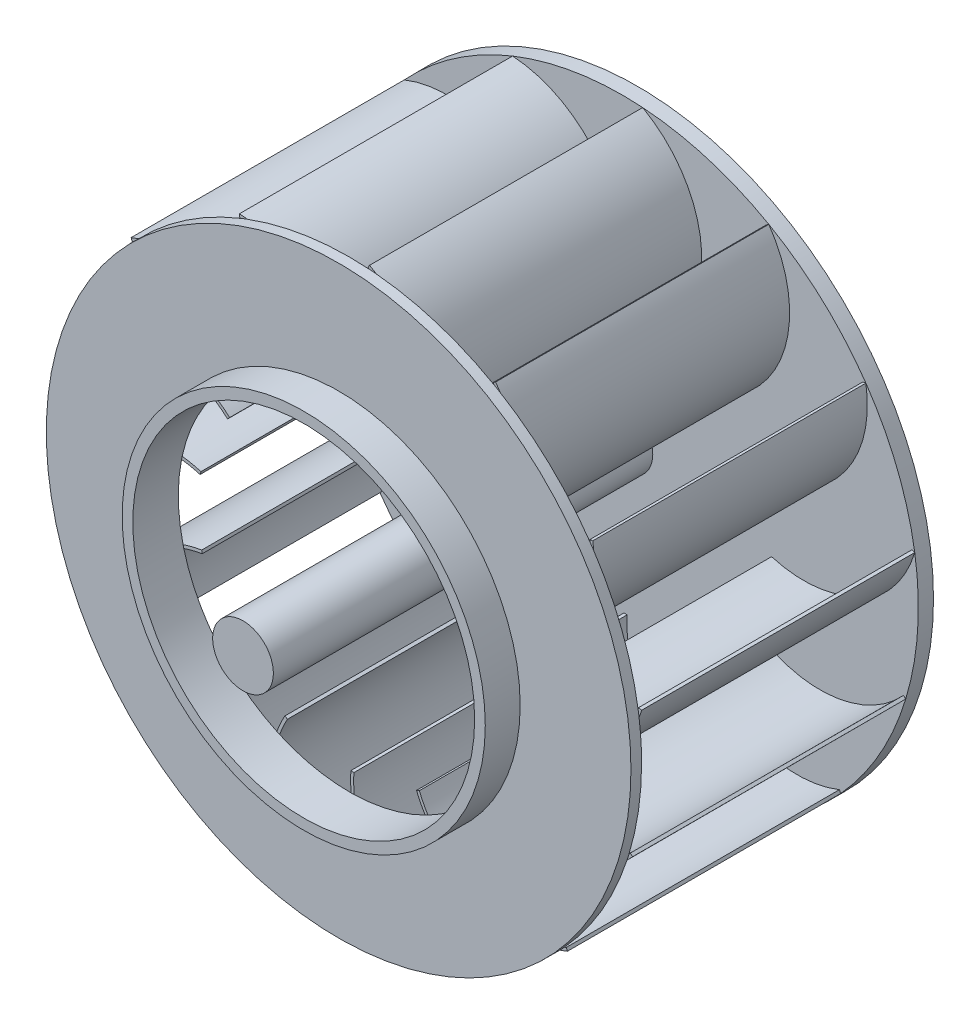
from build123d import *

# Parameters (mm, degrees)
SKETCH1_R                     = 19.5
BOSS_EXTRUDE1_DEPTH           = 0.5
BOSS_EXTRUDE2_DEPTH           = 18
CIRPATTERN1_COUNT             = 18
CIRPATTERN2_COPY_1_SKETCH_R   = 19.5
CIRPATTERN2_COPY_1_DEPTH      = 0.5
CIRPATTERN2_COPY_2_SKETCH_R   = 19.5
CIRPATTERN2_COPY_2_DEPTH      = 0.5
CIRPATTERN2_COPY_3_SKETCH_R   = 19.5
CIRPATTERN2_COPY_3_DEPTH      = 0.5
CIRPATTERN2_COPY_4_SKETCH_R   = 19.5
CIRPATTERN2_COPY_4_DEPTH      = 0.5
CIRPATTERN2_COPY_5_SKETCH_R   = 19.5
CIRPATTERN2_COPY_5_DEPTH      = 0.5
CIRPATTERN2_COPY_6_SKETCH_R   = 19.5
CIRPATTERN2_COPY_6_DEPTH      = 0.5
CIRPATTERN2_COPY_7_SKETCH_R   = 19.5
CIRPATTERN2_COPY_7_DEPTH      = 0.5
CIRPATTERN2_COPY_8_SKETCH_R   = 19.5
CIRPATTERN2_COPY_8_DEPTH      = 0.5
CIRPATTERN2_COPY_9_SKETCH_R   = 19.5
CIRPATTERN2_COPY_9_DEPTH      = 0.5
CIRPATTERN2_COPY_10_SKETCH_R  = 19.5
CIRPATTERN2_COPY_10_DEPTH     = 0.5
CIRPATTERN2_COPY_11_SKETCH_R  = 19.5
CIRPATTERN2_COPY_11_DEPTH     = 0.5
CIRPATTERN2_COPY_12_SKETCH_R  = 19.5
CIRPATTERN2_COPY_12_DEPTH     = 0.5
CIRPATTERN2_COPY_13_SKETCH_R  = 19.5
CIRPATTERN2_COPY_13_DEPTH     = 0.5
CIRPATTERN2_COPY_14_SKETCH_R  = 19.5
CIRPATTERN2_COPY_14_DEPTH     = 0.5
CIRPATTERN2_COPY_15_SKETCH_R  = 19.5
CIRPATTERN2_COPY_15_DEPTH     = 0.5
CIRPATTERN2_COPY_16_SKETCH_R  = 19.5
CIRPATTERN2_COPY_16_DEPTH     = 0.5
CIRPATTERN2_COPY_17_SKETCH_R  = 19.5
CIRPATTERN2_COPY_17_DEPTH     = 0.5
CIRPATTERN2_COPY_18_SKETCH_R  = 19.5
CIRPATTERN2_COPY_18_DEPTH     = 0.5
CIRPATTERN2_COPY_19_SKETCH_R  = 19.5
CIRPATTERN2_COPY_19_DEPTH     = 0.5
CIRPATTERN2_COPY_20_SKETCH_R  = 19.5
CIRPATTERN2_COPY_20_DEPTH     = 0.5
CIRPATTERN2_COPY_21_SKETCH_R  = 19.5
CIRPATTERN2_COPY_21_DEPTH     = 0.5
CIRPATTERN2_COPY_22_SKETCH_R  = 19.5
CIRPATTERN2_COPY_22_DEPTH     = 0.5
CIRPATTERN2_COPY_23_SKETCH_R  = 19.5
CIRPATTERN2_COPY_23_DEPTH     = 0.5
CIRPATTERN2_COPY_24_SKETCH_R  = 19.5
CIRPATTERN2_COPY_24_DEPTH     = 0.5
CIRPATTERN2_COPY_25_SKETCH_R  = 19.5
CIRPATTERN2_COPY_25_DEPTH     = 0.5
CIRPATTERN2_COPY_26_SKETCH_R  = 19.5
CIRPATTERN2_COPY_26_DEPTH     = 0.5
CIRPATTERN2_COPY_27_SKETCH_R  = 19.5
CIRPATTERN2_COPY_27_DEPTH     = 0.5
CIRPATTERN2_COPY_28_SKETCH_R  = 19.5
CIRPATTERN2_COPY_28_DEPTH     = 0.5
CIRPATTERN2_COPY_29_SKETCH_R  = 19.5
CIRPATTERN2_COPY_29_DEPTH     = 0.5
CIRPATTERN2_COPY_30_SKETCH_R  = 19.5
CIRPATTERN2_COPY_30_DEPTH     = 0.5
CIRPATTERN2_COPY_31_SKETCH_R  = 19.5
CIRPATTERN2_COPY_31_DEPTH     = 0.5
CIRPATTERN2_COPY_32_SKETCH_R  = 19.5
CIRPATTERN2_COPY_32_DEPTH     = 0.5
CIRPATTERN2_COPY_33_SKETCH_R  = 19.5
CIRPATTERN2_COPY_33_DEPTH     = 0.5
CIRPATTERN2_COPY_34_SKETCH_R  = 19.5
CIRPATTERN2_COPY_34_DEPTH     = 0.5
CIRPATTERN2_COPY_35_SKETCH_R  = 19.5
CIRPATTERN2_COPY_35_DEPTH     = 0.5
CIRPATTERN2_COPY_36_SKETCH_R  = 19.5
CIRPATTERN2_COPY_36_DEPTH     = 0.5
CIRPATTERN2_COPY_37_SKETCH_R  = 19.5
CIRPATTERN2_COPY_37_DEPTH     = 0.5
CIRPATTERN2_COPY_38_SKETCH_R  = 19.5
CIRPATTERN2_COPY_38_DEPTH     = 0.5
CIRPATTERN2_COPY_39_SKETCH_R  = 19.5
CIRPATTERN2_COPY_39_DEPTH     = 0.5
CIRPATTERN2_COPY_40_SKETCH_R  = 19.5
CIRPATTERN2_COPY_40_DEPTH     = 0.5
CIRPATTERN2_COPY_41_SKETCH_R  = 19.5
CIRPATTERN2_COPY_41_DEPTH     = 0.5
CIRPATTERN2_COPY_42_SKETCH_R  = 19.5
CIRPATTERN2_COPY_42_DEPTH     = 0.5
CIRPATTERN2_COPY_43_SKETCH_R  = 19.5
CIRPATTERN2_COPY_43_DEPTH     = 0.5
CIRPATTERN2_COPY_44_SKETCH_R  = 19.5
CIRPATTERN2_COPY_44_DEPTH     = 0.5
CIRPATTERN2_COPY_45_SKETCH_R  = 19.5
CIRPATTERN2_COPY_45_DEPTH     = 0.5
CIRPATTERN2_COPY_46_SKETCH_R  = 19.5
CIRPATTERN2_COPY_46_DEPTH     = 0.5
CIRPATTERN2_COPY_47_SKETCH_R  = 19.5
CIRPATTERN2_COPY_47_DEPTH     = 0.5
CIRPATTERN2_COPY_48_SKETCH_R  = 19.5
CIRPATTERN2_COPY_48_DEPTH     = 0.5
CIRPATTERN2_COPY_49_SKETCH_R  = 19.5
CIRPATTERN2_COPY_49_DEPTH     = 0.5
CIRPATTERN2_COPY_50_SKETCH_R  = 19.5
CIRPATTERN2_COPY_50_DEPTH     = 0.5
CIRPATTERN2_COPY_51_SKETCH_R  = 19.5
CIRPATTERN2_COPY_51_DEPTH     = 0.5
CIRPATTERN2_COPY_52_SKETCH_R  = 19.5
CIRPATTERN2_COPY_52_DEPTH     = 0.5
CIRPATTERN2_COPY_53_SKETCH_R  = 19.5
CIRPATTERN2_COPY_53_DEPTH     = 0.5
CIRPATTERN2_COPY_54_SKETCH_R  = 19.5
CIRPATTERN2_COPY_54_DEPTH     = 0.5
CIRPATTERN2_COPY_55_SKETCH_R  = 19.5
CIRPATTERN2_COPY_55_DEPTH     = 0.5
CIRPATTERN2_COPY_56_SKETCH_R  = 19.5
CIRPATTERN2_COPY_56_DEPTH     = 0.5
CIRPATTERN2_COPY_57_SKETCH_R  = 19.5
CIRPATTERN2_COPY_57_DEPTH     = 0.5
CIRPATTERN2_COPY_58_SKETCH_R  = 19.5
CIRPATTERN2_COPY_58_DEPTH     = 0.5
CIRPATTERN2_COPY_59_SKETCH_R  = 19.5
CIRPATTERN2_COPY_59_DEPTH     = 0.5
CIRPATTERN2_COPY_60_SKETCH_R  = 19.5
CIRPATTERN2_COPY_60_DEPTH     = 0.5
CIRPATTERN2_COPY_61_SKETCH_R  = 19.5
CIRPATTERN2_COPY_61_DEPTH     = 0.5
CIRPATTERN2_COPY_62_SKETCH_R  = 19.5
CIRPATTERN2_COPY_62_DEPTH     = 0.5
CIRPATTERN2_COPY_63_SKETCH_R  = 19.5
CIRPATTERN2_COPY_63_DEPTH     = 0.5
CIRPATTERN2_COPY_64_SKETCH_R  = 19.5
CIRPATTERN2_COPY_64_DEPTH     = 0.5
CIRPATTERN2_COPY_65_SKETCH_R  = 19.5
CIRPATTERN2_COPY_65_DEPTH     = 0.5
CIRPATTERN2_COPY_66_SKETCH_R  = 19.5
CIRPATTERN2_COPY_66_DEPTH     = 0.5
CIRPATTERN2_COPY_67_SKETCH_R  = 19.5
CIRPATTERN2_COPY_67_DEPTH     = 0.5
CIRPATTERN2_COPY_68_SKETCH_R  = 19.5
CIRPATTERN2_COPY_68_DEPTH     = 0.5
CIRPATTERN2_COPY_69_SKETCH_R  = 19.5
CIRPATTERN2_COPY_69_DEPTH     = 0.5
CIRPATTERN2_COPY_70_SKETCH_R  = 19.5
CIRPATTERN2_COPY_70_DEPTH     = 0.5
CIRPATTERN2_COPY_71_SKETCH_R  = 19.5
CIRPATTERN2_COPY_71_DEPTH     = 0.5
CIRPATTERN2_COPY_72_SKETCH_R  = 19.5
CIRPATTERN2_COPY_72_DEPTH     = 0.5
CIRPATTERN2_COPY_73_SKETCH_R  = 19.5
CIRPATTERN2_COPY_73_DEPTH     = 0.5
CIRPATTERN2_COPY_74_SKETCH_R  = 19.5
CIRPATTERN2_COPY_74_DEPTH     = 0.5
CIRPATTERN2_COPY_75_SKETCH_R  = 19.5
CIRPATTERN2_COPY_75_DEPTH     = 0.5
CIRPATTERN2_COPY_76_SKETCH_R  = 19.5
CIRPATTERN2_COPY_76_DEPTH     = 0.5
CIRPATTERN2_COPY_77_SKETCH_R  = 19.5
CIRPATTERN2_COPY_77_DEPTH     = 0.5
CIRPATTERN2_COPY_78_SKETCH_R  = 19.5
CIRPATTERN2_COPY_78_DEPTH     = 0.5
CIRPATTERN2_COPY_79_SKETCH_R  = 19.5
CIRPATTERN2_COPY_79_DEPTH     = 0.5
CIRPATTERN2_COPY_80_SKETCH_R  = 19.5
CIRPATTERN2_COPY_80_DEPTH     = 0.5
CIRPATTERN2_COPY_81_SKETCH_R  = 19.5
CIRPATTERN2_COPY_81_DEPTH     = 0.5
CIRPATTERN2_COPY_82_SKETCH_R  = 19.5
CIRPATTERN2_COPY_82_DEPTH     = 0.5
CIRPATTERN2_COPY_83_SKETCH_R  = 19.5
CIRPATTERN2_COPY_83_DEPTH     = 0.5
CIRPATTERN2_COPY_84_SKETCH_R  = 19.5
CIRPATTERN2_COPY_84_DEPTH     = 0.5
CIRPATTERN2_COPY_85_SKETCH_R  = 19.5
CIRPATTERN2_COPY_85_DEPTH     = 0.5
CIRPATTERN2_COPY_86_SKETCH_R  = 19.5
CIRPATTERN2_COPY_86_DEPTH     = 0.5
CIRPATTERN2_COPY_87_SKETCH_R  = 19.5
CIRPATTERN2_COPY_87_DEPTH     = 0.5
CIRPATTERN2_COPY_88_SKETCH_R  = 19.5
CIRPATTERN2_COPY_88_DEPTH     = 0.5
CIRPATTERN2_COPY_89_SKETCH_R  = 19.5
CIRPATTERN2_COPY_89_DEPTH     = 0.5
CIRPATTERN2_COPY_90_SKETCH_R  = 19.5
CIRPATTERN2_COPY_90_DEPTH     = 0.5
CIRPATTERN2_COPY_91_SKETCH_R  = 19.5
CIRPATTERN2_COPY_91_DEPTH     = 0.5
CIRPATTERN2_COPY_92_SKETCH_R  = 19.5
CIRPATTERN2_COPY_92_DEPTH     = 0.5
CIRPATTERN2_COPY_93_SKETCH_R  = 19.5
CIRPATTERN2_COPY_93_DEPTH     = 0.5
CIRPATTERN2_COPY_94_SKETCH_R  = 19.5
CIRPATTERN2_COPY_94_DEPTH     = 0.5
CIRPATTERN2_COPY_95_SKETCH_R  = 19.5
CIRPATTERN2_COPY_95_DEPTH     = 0.5
CIRPATTERN2_COPY_96_SKETCH_R  = 19.5
CIRPATTERN2_COPY_96_DEPTH     = 0.5
CIRPATTERN2_COPY_97_SKETCH_R  = 19.5
CIRPATTERN2_COPY_97_DEPTH     = 0.5
CIRPATTERN2_COPY_98_SKETCH_R  = 19.5
CIRPATTERN2_COPY_98_DEPTH     = 0.5
CIRPATTERN2_COPY_99_SKETCH_R  = 19.5
CIRPATTERN2_COPY_99_DEPTH     = 0.5
CIRPATTERN2_COPY_100_SKETCH_R = 19.5
CIRPATTERN2_COPY_100_DEPTH    = 0.5
CIRPATTERN2_COPY_101_SKETCH_R = 19.5
CIRPATTERN2_COPY_101_DEPTH    = 0.5
CIRPATTERN2_COPY_102_SKETCH_R = 19.5
CIRPATTERN2_COPY_102_DEPTH    = 0.5
CIRPATTERN2_COPY_103_SKETCH_R = 19.5
CIRPATTERN2_COPY_103_DEPTH    = 0.5
CIRPATTERN2_COPY_104_SKETCH_R = 19.5
CIRPATTERN2_COPY_104_DEPTH    = 0.5
CIRPATTERN2_COPY_105_SKETCH_R = 19.5
CIRPATTERN2_COPY_105_DEPTH    = 0.5
CIRPATTERN2_COPY_106_SKETCH_R = 19.5
CIRPATTERN2_COPY_106_DEPTH    = 0.5
CIRPATTERN2_COPY_107_SKETCH_R = 19.5
CIRPATTERN2_COPY_107_DEPTH    = 0.5
CIRPATTERN2_COPY_108_SKETCH_R = 19.5
CIRPATTERN2_COPY_108_DEPTH    = 0.5
CIRPATTERN2_COPY_109_SKETCH_R = 19.5
CIRPATTERN2_COPY_109_DEPTH    = 0.5
CIRPATTERN2_COPY_110_SKETCH_R = 19.5
CIRPATTERN2_COPY_110_DEPTH    = 0.5
CIRPATTERN2_COPY_111_SKETCH_R = 19.5
CIRPATTERN2_COPY_111_DEPTH    = 0.5
CIRPATTERN2_COPY_112_SKETCH_R = 19.5
CIRPATTERN2_COPY_112_DEPTH    = 0.5
CIRPATTERN2_COPY_113_SKETCH_R = 19.5
CIRPATTERN2_COPY_113_DEPTH    = 0.5
CIRPATTERN2_COPY_114_SKETCH_R = 19.5
CIRPATTERN2_COPY_114_DEPTH    = 0.5
CIRPATTERN2_COPY_115_SKETCH_R = 19.5
CIRPATTERN2_COPY_115_DEPTH    = 0.5
CIRPATTERN2_COPY_116_SKETCH_R = 19.5
CIRPATTERN2_COPY_116_DEPTH    = 0.5
CIRPATTERN2_COPY_117_SKETCH_R = 19.5
CIRPATTERN2_COPY_117_DEPTH    = 0.5
CIRPATTERN2_COPY_118_SKETCH_R = 19.5
CIRPATTERN2_COPY_118_DEPTH    = 0.5
CIRPATTERN2_COPY_119_SKETCH_R = 19.5
CIRPATTERN2_COPY_119_DEPTH    = 0.5
CIRPATTERN2_COPY_120_SKETCH_R = 19.5
CIRPATTERN2_COPY_120_DEPTH    = 0.5
CIRPATTERN2_COPY_121_SKETCH_R = 19.5
CIRPATTERN2_COPY_121_DEPTH    = 0.5
CIRPATTERN2_COPY_122_SKETCH_R = 19.5
CIRPATTERN2_COPY_122_DEPTH    = 0.5
CIRPATTERN2_COPY_123_SKETCH_R = 19.5
CIRPATTERN2_COPY_123_DEPTH    = 0.5
CIRPATTERN2_COPY_124_SKETCH_R = 19.5
CIRPATTERN2_COPY_124_DEPTH    = 0.5
CIRPATTERN2_COPY_125_SKETCH_R = 19.5
CIRPATTERN2_COPY_125_DEPTH    = 0.5
CIRPATTERN2_COPY_126_SKETCH_R = 19.5
CIRPATTERN2_COPY_126_DEPTH    = 0.5
CIRPATTERN2_COPY_127_SKETCH_R = 19.5
CIRPATTERN2_COPY_127_DEPTH    = 0.5
CIRPATTERN2_COPY_128_SKETCH_R = 19.5
CIRPATTERN2_COPY_128_DEPTH    = 0.5
CIRPATTERN2_COPY_129_SKETCH_R = 19.5
CIRPATTERN2_COPY_129_DEPTH    = 0.5
CIRPATTERN2_COPY_130_SKETCH_R = 19.5
CIRPATTERN2_COPY_130_DEPTH    = 0.5
CIRPATTERN2_COPY_131_SKETCH_R = 19.5
CIRPATTERN2_COPY_131_DEPTH    = 0.5
CIRPATTERN2_COPY_132_SKETCH_R = 19.5
CIRPATTERN2_COPY_132_DEPTH    = 0.5
CIRPATTERN2_COPY_133_SKETCH_R = 19.5
CIRPATTERN2_COPY_133_DEPTH    = 0.5
CIRPATTERN2_COPY_134_SKETCH_R = 19.5
CIRPATTERN2_COPY_134_DEPTH    = 0.5
CIRPATTERN2_COPY_135_SKETCH_R = 19.5
CIRPATTERN2_COPY_135_DEPTH    = 0.5
CIRPATTERN2_COPY_136_SKETCH_R = 19.5
CIRPATTERN2_COPY_136_DEPTH    = 0.5
CIRPATTERN2_COPY_137_SKETCH_R = 19.5
CIRPATTERN2_COPY_137_DEPTH    = 0.5
CIRPATTERN2_COPY_138_SKETCH_R = 19.5
CIRPATTERN2_COPY_138_DEPTH    = 0.5
CIRPATTERN2_COPY_139_SKETCH_R = 19.5
CIRPATTERN2_COPY_139_DEPTH    = 0.5
CIRPATTERN2_COPY_140_SKETCH_R = 19.5
CIRPATTERN2_COPY_140_DEPTH    = 0.5
CIRPATTERN2_COPY_141_SKETCH_R = 19.5
CIRPATTERN2_COPY_141_DEPTH    = 0.5
CIRPATTERN2_COPY_142_SKETCH_R = 19.5
CIRPATTERN2_COPY_142_DEPTH    = 0.5
CIRPATTERN2_COPY_143_SKETCH_R = 19.5
CIRPATTERN2_COPY_143_DEPTH    = 0.5
CIRPATTERN2_COPY_144_SKETCH_R = 19.5
CIRPATTERN2_COPY_144_DEPTH    = 0.5
CIRPATTERN2_COPY_145_SKETCH_R = 19.5
CIRPATTERN2_COPY_145_DEPTH    = 0.5
CIRPATTERN2_COPY_146_SKETCH_R = 19.5
CIRPATTERN2_COPY_146_DEPTH    = 0.5
CIRPATTERN2_COPY_147_SKETCH_R = 19.5
CIRPATTERN2_COPY_147_DEPTH    = 0.5
CIRPATTERN2_COPY_148_SKETCH_R = 19.5
CIRPATTERN2_COPY_148_DEPTH    = 0.5
CIRPATTERN2_COPY_149_SKETCH_R = 19.5
CIRPATTERN2_COPY_149_DEPTH    = 0.5
CIRPATTERN2_COPY_150_SKETCH_R = 19.5
CIRPATTERN2_COPY_150_DEPTH    = 0.5
CIRPATTERN2_COPY_151_SKETCH_R = 19.5
CIRPATTERN2_COPY_151_DEPTH    = 0.5
CIRPATTERN2_COPY_152_SKETCH_R = 19.5
CIRPATTERN2_COPY_152_DEPTH    = 0.5
CIRPATTERN2_COPY_153_SKETCH_R = 19.5
CIRPATTERN2_COPY_153_DEPTH    = 0.5
CIRPATTERN2_COPY_154_SKETCH_R = 19.5
CIRPATTERN2_COPY_154_DEPTH    = 0.5
CIRPATTERN2_COPY_155_SKETCH_R = 19.5
CIRPATTERN2_COPY_155_DEPTH    = 0.5
CIRPATTERN2_COPY_156_SKETCH_R = 19.5
CIRPATTERN2_COPY_156_DEPTH    = 0.5
CIRPATTERN2_COPY_157_SKETCH_R = 19.5
CIRPATTERN2_COPY_157_DEPTH    = 0.5
CIRPATTERN2_COPY_158_SKETCH_R = 19.5
CIRPATTERN2_COPY_158_DEPTH    = 0.5
CIRPATTERN2_COPY_159_SKETCH_R = 19.5
CIRPATTERN2_COPY_159_DEPTH    = 0.5
CIRPATTERN2_COPY_160_SKETCH_R = 19.5
CIRPATTERN2_COPY_160_DEPTH    = 0.5
CIRPATTERN2_COPY_161_SKETCH_R = 19.5
CIRPATTERN2_COPY_161_DEPTH    = 0.5
CIRPATTERN2_COPY_162_SKETCH_R = 19.5
CIRPATTERN2_COPY_162_DEPTH    = 0.5
CIRPATTERN2_COPY_163_SKETCH_R = 19.5
CIRPATTERN2_COPY_163_DEPTH    = 0.5
CIRPATTERN2_COPY_164_SKETCH_R = 19.5
CIRPATTERN2_COPY_164_DEPTH    = 0.5
CIRPATTERN2_COPY_165_SKETCH_R = 19.5
CIRPATTERN2_COPY_165_DEPTH    = 0.5
CIRPATTERN2_COPY_166_SKETCH_R = 19.5
CIRPATTERN2_COPY_166_DEPTH    = 0.5
CIRPATTERN2_COPY_167_SKETCH_R = 19.5
CIRPATTERN2_COPY_167_DEPTH    = 0.5
CIRPATTERN2_COPY_168_SKETCH_R = 19.5
CIRPATTERN2_COPY_168_DEPTH    = 0.5
CIRPATTERN2_COPY_169_SKETCH_R = 19.5
CIRPATTERN2_COPY_169_DEPTH    = 0.5
CIRPATTERN2_COPY_170_SKETCH_R = 19.5
CIRPATTERN2_COPY_170_DEPTH    = 0.5
CIRPATTERN2_COPY_171_SKETCH_R = 19.5
CIRPATTERN2_COPY_171_DEPTH    = 0.5
CIRPATTERN2_COPY_172_SKETCH_R = 19.5
CIRPATTERN2_COPY_172_DEPTH    = 0.5
CIRPATTERN2_COPY_173_SKETCH_R = 19.5
CIRPATTERN2_COPY_173_DEPTH    = 0.5
CIRPATTERN2_COPY_174_SKETCH_R = 19.5
CIRPATTERN2_COPY_174_DEPTH    = 0.5
CIRPATTERN2_COPY_175_SKETCH_R = 19.5
CIRPATTERN2_COPY_175_DEPTH    = 0.5
CIRPATTERN2_COPY_176_SKETCH_R = 19.5
CIRPATTERN2_COPY_176_DEPTH    = 0.5
CIRPATTERN2_COPY_177_SKETCH_R = 19.5
CIRPATTERN2_COPY_177_DEPTH    = 0.5
CIRPATTERN2_COPY_178_SKETCH_R = 19.5
CIRPATTERN2_COPY_178_DEPTH    = 0.5
CIRPATTERN2_COPY_179_SKETCH_R = 19.5
CIRPATTERN2_COPY_179_DEPTH    = 0.5
CIRPATTERN2_COPY_180_SKETCH_R = 19.5
CIRPATTERN2_COPY_180_DEPTH    = 0.5
CIRPATTERN2_COPY_181_SKETCH_R = 19.5
CIRPATTERN2_COPY_181_DEPTH    = 0.5
CIRPATTERN2_COPY_182_SKETCH_R = 19.5
CIRPATTERN2_COPY_182_DEPTH    = 0.5
CIRPATTERN2_COPY_183_SKETCH_R = 19.5
CIRPATTERN2_COPY_183_DEPTH    = 0.5
CIRPATTERN2_COPY_184_SKETCH_R = 19.5
CIRPATTERN2_COPY_184_DEPTH    = 0.5
CIRPATTERN2_COPY_185_SKETCH_R = 19.5
CIRPATTERN2_COPY_185_DEPTH    = 0.5
CIRPATTERN2_COPY_186_SKETCH_R = 19.5
CIRPATTERN2_COPY_186_DEPTH    = 0.5
CIRPATTERN2_COPY_187_SKETCH_R = 19.5
CIRPATTERN2_COPY_187_DEPTH    = 0.5
CIRPATTERN2_COPY_188_SKETCH_R = 19.5
CIRPATTERN2_COPY_188_DEPTH    = 0.5
CIRPATTERN2_COPY_189_SKETCH_R = 19.5
CIRPATTERN2_COPY_189_DEPTH    = 0.5
CIRPATTERN2_COPY_190_SKETCH_R = 19.5
CIRPATTERN2_COPY_190_DEPTH    = 0.5
CIRPATTERN2_COPY_191_SKETCH_R = 19.5
CIRPATTERN2_COPY_191_DEPTH    = 0.5
CIRPATTERN2_COPY_192_SKETCH_R = 19.5
CIRPATTERN2_COPY_192_DEPTH    = 0.5
CIRPATTERN2_COPY_193_SKETCH_R = 19.5
CIRPATTERN2_COPY_193_DEPTH    = 0.5
CIRPATTERN2_COPY_194_SKETCH_R = 19.5
CIRPATTERN2_COPY_194_DEPTH    = 0.5
CIRPATTERN2_COPY_195_SKETCH_R = 19.5
CIRPATTERN2_COPY_195_DEPTH    = 0.5
CIRPATTERN2_COPY_196_SKETCH_R = 19.5
CIRPATTERN2_COPY_196_DEPTH    = 0.5
CIRPATTERN2_COPY_197_SKETCH_R = 19.5
CIRPATTERN2_COPY_197_DEPTH    = 0.5
CIRPATTERN2_COPY_198_SKETCH_R = 19.5
CIRPATTERN2_COPY_198_DEPTH    = 0.5
CIRPATTERN2_COPY_199_SKETCH_R = 19.5
CIRPATTERN2_COPY_199_DEPTH    = 0.5
CIRPATTERN2_COPY_200_SKETCH_R = 19.5
CIRPATTERN2_COPY_200_DEPTH    = 0.5
CIRPATTERN2_COPY_201_SKETCH_R = 19.5
CIRPATTERN2_COPY_201_DEPTH    = 0.5
CIRPATTERN2_COPY_202_SKETCH_R = 19.5
CIRPATTERN2_COPY_202_DEPTH    = 0.5
CIRPATTERN2_COPY_203_SKETCH_R = 19.5
CIRPATTERN2_COPY_203_DEPTH    = 0.5
CIRPATTERN2_COPY_204_SKETCH_R = 19.5
CIRPATTERN2_COPY_204_DEPTH    = 0.5
CIRPATTERN2_COPY_205_SKETCH_R = 19.5
CIRPATTERN2_COPY_205_DEPTH    = 0.5
CIRPATTERN2_COPY_206_SKETCH_R = 19.5
CIRPATTERN2_COPY_206_DEPTH    = 0.5
CIRPATTERN2_COPY_207_SKETCH_R = 19.5
CIRPATTERN2_COPY_207_DEPTH    = 0.5
CIRPATTERN2_COPY_208_SKETCH_R = 19.5
CIRPATTERN2_COPY_208_DEPTH    = 0.5
CIRPATTERN2_COPY_209_SKETCH_R = 19.5
CIRPATTERN2_COPY_209_DEPTH    = 0.5
CIRPATTERN2_COPY_210_SKETCH_R = 19.5
CIRPATTERN2_COPY_210_DEPTH    = 0.5
CIRPATTERN2_COPY_211_SKETCH_R = 19.5
CIRPATTERN2_COPY_211_DEPTH    = 0.5
CIRPATTERN2_COPY_212_SKETCH_R = 19.5
CIRPATTERN2_COPY_212_DEPTH    = 0.5
CIRPATTERN2_COPY_213_SKETCH_R = 19.5
CIRPATTERN2_COPY_213_DEPTH    = 0.5
CIRPATTERN2_COPY_214_SKETCH_R = 19.5
CIRPATTERN2_COPY_214_DEPTH    = 0.5
CIRPATTERN2_COPY_215_SKETCH_R = 19.5
CIRPATTERN2_COPY_215_DEPTH    = 0.5
CIRPATTERN2_COPY_216_SKETCH_R = 19.5
CIRPATTERN2_COPY_216_DEPTH    = 0.5
CIRPATTERN2_COPY_217_SKETCH_R = 19.5
CIRPATTERN2_COPY_217_DEPTH    = 0.5
CIRPATTERN2_COPY_218_SKETCH_R = 19.5
CIRPATTERN2_COPY_218_DEPTH    = 0.5
CIRPATTERN2_COPY_219_SKETCH_R = 19.5
CIRPATTERN2_COPY_219_DEPTH    = 0.5
CIRPATTERN2_COPY_220_SKETCH_R = 19.5
CIRPATTERN2_COPY_220_DEPTH    = 0.5
CIRPATTERN2_COPY_221_SKETCH_R = 19.5
CIRPATTERN2_COPY_221_DEPTH    = 0.5
CIRPATTERN2_COPY_222_SKETCH_R = 19.5
CIRPATTERN2_COPY_222_DEPTH    = 0.5
CIRPATTERN2_COPY_223_SKETCH_R = 19.5
CIRPATTERN2_COPY_223_DEPTH    = 0.5
CIRPATTERN2_COPY_224_SKETCH_R = 19.5
CIRPATTERN2_COPY_224_DEPTH    = 0.5
CIRPATTERN2_COPY_225_SKETCH_R = 19.5
CIRPATTERN2_COPY_225_DEPTH    = 0.5
CIRPATTERN2_COPY_226_SKETCH_R = 19.5
CIRPATTERN2_COPY_226_DEPTH    = 0.5
CIRPATTERN2_COPY_227_SKETCH_R = 19.5
CIRPATTERN2_COPY_227_DEPTH    = 0.5
CIRPATTERN2_COPY_228_SKETCH_R = 19.5
CIRPATTERN2_COPY_228_DEPTH    = 0.5
CIRPATTERN2_COPY_229_SKETCH_R = 19.5
CIRPATTERN2_COPY_229_DEPTH    = 0.5
CIRPATTERN2_COPY_230_SKETCH_R = 19.5
CIRPATTERN2_COPY_230_DEPTH    = 0.5
CIRPATTERN2_COPY_231_SKETCH_R = 19.5
CIRPATTERN2_COPY_231_DEPTH    = 0.5
CIRPATTERN2_COPY_232_SKETCH_R = 19.5
CIRPATTERN2_COPY_232_DEPTH    = 0.5
CIRPATTERN2_COPY_233_SKETCH_R = 19.5
CIRPATTERN2_COPY_233_DEPTH    = 0.5
CIRPATTERN2_COPY_234_SKETCH_R = 19.5
CIRPATTERN2_COPY_234_DEPTH    = 0.5
CIRPATTERN3_COUNT             = 14
BOSS_EXTRUDE3_DEPTH           = 25
BOSS_EXTRUDE3_DEPTH_BACK      = 13
SKETCH4_R                     = 2
FILLET1_R                     = 0.7


with BuildPart() as part:
    # Sketch1 → Boss-Extrude1 (new, symmetric)
    with BuildSketch(Plane.XY):
        Circle(SKETCH1_R)
    boss_extrude1 = extrude(amount=BOSS_EXTRUDE1_DEPTH, both=True)

    # Sketch2 → Boss-Extrude2 (add)
    with BuildSketch(Plane.XY.offset(0.5)):
        with BuildLine():
            Line((1.337814663, 19.454054897), (1.239670135, 19.279791729))
            ThreePointArc((1.239670135, 19.279791729), (4.751835626, 14.802478119), (4.069372846, 9.153063268))
            Line((4.069372846, 9.153063268), (4.243636014, 9.05491874))
            ThreePointArc((4.243636014, 9.05491874), (4.944456955, 14.856302125), (1.337814663, 19.454054897))
        make_face()
    boss_extrude2 = extrude(amount=BOSS_EXTRUDE2_DEPTH)


with BuildPart() as cirpattern1_1:
    # CirPattern1: pattern copy
    add(boss_extrude1.rotate(Axis((0, 0, 0.5), (0, 0, 1)), 1 * 360 / CIRPATTERN1_COUNT))


with BuildPart() as cirpattern1_2:
    # CirPattern1: pattern copy
    add(boss_extrude1.rotate(Axis((0, 0, 0.5), (0, 0, 1)), 2 * 360 / CIRPATTERN1_COUNT))


with BuildPart() as cirpattern1_3:
    # CirPattern1: pattern copy
    add(boss_extrude1.rotate(Axis((0, 0, 0.5), (0, 0, 1)), 3 * 360 / CIRPATTERN1_COUNT))


with BuildPart() as cirpattern1_4:
    # CirPattern1: pattern copy
    add(boss_extrude1.rotate(Axis((0, 0, 0.5), (0, 0, 1)), 4 * 360 / CIRPATTERN1_COUNT))


with BuildPart() as cirpattern1_5:
    # CirPattern1: pattern copy
    add(boss_extrude1.rotate(Axis((0, 0, 0.5), (0, 0, 1)), 5 * 360 / CIRPATTERN1_COUNT))


with BuildPart() as cirpattern1_6:
    # CirPattern1: pattern copy
    add(boss_extrude1.rotate(Axis((0, 0, 0.5), (0, 0, 1)), 6 * 360 / CIRPATTERN1_COUNT))


with BuildPart() as cirpattern1_7:
    # CirPattern1: pattern copy
    add(boss_extrude1.rotate(Axis((0, 0, 0.5), (0, 0, 1)), 7 * 360 / CIRPATTERN1_COUNT))


with BuildPart() as cirpattern1_8:
    # CirPattern1: pattern copy
    add(boss_extrude1.rotate(Axis((0, 0, 0.5), (0, 0, 1)), 8 * 360 / CIRPATTERN1_COUNT))


with BuildPart() as cirpattern1_9:
    # CirPattern1: pattern copy
    add(boss_extrude1.rotate(Axis((0, 0, 0.5), (0, 0, 1)), 9 * 360 / CIRPATTERN1_COUNT))


with BuildPart() as cirpattern1_10:
    # CirPattern1: pattern copy
    add(boss_extrude1.rotate(Axis((0, 0, 0.5), (0, 0, 1)), 10 * 360 / CIRPATTERN1_COUNT))


with BuildPart() as cirpattern1_11:
    # CirPattern1: pattern copy
    add(boss_extrude1.rotate(Axis((0, 0, 0.5), (0, 0, 1)), 11 * 360 / CIRPATTERN1_COUNT))


with BuildPart() as cirpattern1_12:
    # CirPattern1: pattern copy
    add(boss_extrude1.rotate(Axis((0, 0, 0.5), (0, 0, 1)), 12 * 360 / CIRPATTERN1_COUNT))


with BuildPart() as cirpattern1_13:
    # CirPattern1: pattern copy
    add(boss_extrude1.rotate(Axis((0, 0, 0.5), (0, 0, 1)), 13 * 360 / CIRPATTERN1_COUNT))


with BuildPart() as cirpattern1_14:
    # CirPattern1: pattern copy
    add(boss_extrude1.rotate(Axis((0, 0, 0.5), (0, 0, 1)), 14 * 360 / CIRPATTERN1_COUNT))


with BuildPart() as cirpattern1_15:
    # CirPattern1: pattern copy
    add(boss_extrude1.rotate(Axis((0, 0, 0.5), (0, 0, 1)), 15 * 360 / CIRPATTERN1_COUNT))


with BuildPart() as cirpattern1_16:
    # CirPattern1: pattern copy
    add(boss_extrude1.rotate(Axis((0, 0, 0.5), (0, 0, 1)), 16 * 360 / CIRPATTERN1_COUNT))


with BuildPart() as cirpattern1_17:
    # CirPattern1: pattern copy
    add(boss_extrude1.rotate(Axis((0, 0, 0.5), (0, 0, 1)), 17 * 360 / CIRPATTERN1_COUNT))


with BuildPart() as part_1:
    add(part.part)

    # CirPattern1 united with what the copies: union CirPattern1_1, CirPattern1_2, CirPattern1_3, CirPattern1_4, CirPattern1_5, CirPattern1_6, CirPattern1_7, CirPattern1_8, CirPattern1_9, CirPattern1_10, CirPattern1_11, CirPattern1_12, CirPattern1_13, CirPattern1_14, CirPattern1_15, CirPattern1_16, CirPattern1_17
    add(cirpattern1_1.part)
    add(cirpattern1_2.part)
    add(cirpattern1_3.part)
    add(cirpattern1_4.part)
    add(cirpattern1_5.part)
    add(cirpattern1_6.part)
    add(cirpattern1_7.part)
    add(cirpattern1_8.part)
    add(cirpattern1_9.part)
    add(cirpattern1_10.part)
    add(cirpattern1_11.part)
    add(cirpattern1_12.part)
    add(cirpattern1_13.part)
    add(cirpattern1_14.part)
    add(cirpattern1_15.part)
    add(cirpattern1_16.part)
    add(cirpattern1_17.part)

    # CirPattern2 copy 1 sketch → CirPattern2 copy 1 (add, symmetric)
    with BuildSketch(Plane(origin=(0, 0, 0), x_dir=(0.6982368180860729, 0.7158668492597184, 0), z_dir=(0, 0, 1))):
        Circle(CIRPATTERN2_COPY_1_SKETCH_R)
    extrude(amount=CIRPATTERN2_COPY_1_DEPTH, both=True)

    # CirPattern2 copy 2 sketch → CirPattern2 copy 2 (add, symmetric)
    with BuildSketch(Plane(origin=(0, 0, 0), x_dir=(0.3184866502516846, 0.9479273461671318, 0), z_dir=(0, 0, 1))):
        Circle(CIRPATTERN2_COPY_2_SKETCH_R)
    extrude(amount=CIRPATTERN2_COPY_2_DEPTH, both=True)

    # CirPattern2 copy 3 sketch → CirPattern2 copy 3 (add, symmetric)
    with BuildSketch(Plane(origin=(0, 0, 0), x_dir=(-0.12434370464748512, 0.9922392066001722, 0), z_dir=(0, 0, 1))):
        Circle(CIRPATTERN2_COPY_3_SKETCH_R)
    extrude(amount=CIRPATTERN2_COPY_3_DEPTH, both=True)

    # CirPattern2 copy 4 sketch → CirPattern2 copy 4 (add, symmetric)
    with BuildSketch(Plane(origin=(0, 0, 0), x_dir=(-0.5425462638657593, 0.8400259231507715, 0), z_dir=(0, 0, 1))):
        Circle(CIRPATTERN2_COPY_4_SKETCH_R)
    extrude(amount=CIRPATTERN2_COPY_4_DEPTH, both=True)

    # CirPattern2 copy 5 sketch → CirPattern2 copy 5 (add, symmetric)
    with BuildSketch(Plane(origin=(0, 0, 0), x_dir=(-0.8532908816321558, 0.5214352033794978, 0), z_dir=(0, 0, 1))):
        Circle(CIRPATTERN2_COPY_5_SKETCH_R)
    extrude(amount=CIRPATTERN2_COPY_5_DEPTH, both=True)

    # CirPattern2 copy 6 sketch → CirPattern2 copy 6 (add, symmetric)
    with BuildSketch(Plane(origin=(0, 0, 0), x_dir=(-0.9950307753654013, 0.0995678465958168, 0), z_dir=(0, 0, 1))):
        Circle(CIRPATTERN2_COPY_6_SKETCH_R)
    extrude(amount=CIRPATTERN2_COPY_6_DEPTH, both=True)

    # CirPattern2 copy 7 sketch → CirPattern2 copy 7 (add, symmetric)
    with BuildSketch(Plane(origin=(0, 0, 0), x_dir=(-0.9396926207859084, -0.3420201433256686, 0), z_dir=(0, 0, 1))):
        Circle(CIRPATTERN2_COPY_7_SKETCH_R)
    extrude(amount=CIRPATTERN2_COPY_7_DEPTH, both=True)

    # CirPattern2 copy 8 sketch → CirPattern2 copy 8 (add, symmetric)
    with BuildSketch(Plane(origin=(0, 0, 0), x_dir=(-0.6982368180860729, -0.7158668492597184, 0), z_dir=(0, 0, 1))):
        Circle(CIRPATTERN2_COPY_8_SKETCH_R)
    extrude(amount=CIRPATTERN2_COPY_8_DEPTH, both=True)

    # CirPattern2 copy 9 sketch → CirPattern2 copy 9 (add, symmetric)
    with BuildSketch(Plane(origin=(0, 0, 0), x_dir=(-0.3184866502516846, -0.9479273461671317, 0), z_dir=(0, 0, 1))):
        Circle(CIRPATTERN2_COPY_9_SKETCH_R)
    extrude(amount=CIRPATTERN2_COPY_9_DEPTH, both=True)

    # CirPattern2 copy 10 sketch → CirPattern2 copy 10 (add, symmetric)
    with BuildSketch(Plane(origin=(0, 0, 0), x_dir=(0.12434370464748587, -0.992239206600172, 0), z_dir=(0, 0, 1))):
        Circle(CIRPATTERN2_COPY_10_SKETCH_R)
    extrude(amount=CIRPATTERN2_COPY_10_DEPTH, both=True)

    # CirPattern2 copy 11 sketch → CirPattern2 copy 11 (add, symmetric)
    with BuildSketch(Plane(origin=(0, 0, 0), x_dir=(0.54254626386576, -0.840025923150771, 0), z_dir=(0, 0, 1))):
        Circle(CIRPATTERN2_COPY_11_SKETCH_R)
    extrude(amount=CIRPATTERN2_COPY_11_DEPTH, both=True)

    # CirPattern2 copy 12 sketch → CirPattern2 copy 12 (add, symmetric)
    with BuildSketch(Plane(origin=(0, 0, 0), x_dir=(0.8532908816321556, -0.5214352033794982, 0), z_dir=(0, 0, 1))):
        Circle(CIRPATTERN2_COPY_12_SKETCH_R)
    extrude(amount=CIRPATTERN2_COPY_12_DEPTH, both=True)

    # CirPattern2 copy 13 sketch → CirPattern2 copy 13 (add, symmetric)
    with BuildSketch(Plane(origin=(0, 0, 0), x_dir=(0.9950307753654014, -0.09956784659581691, 0), z_dir=(0, 0, 1))):
        Circle(CIRPATTERN2_COPY_13_SKETCH_R)
    extrude(amount=CIRPATTERN2_COPY_13_DEPTH, both=True)

    # CirPattern2 copy 14 sketch → CirPattern2 copy 14 (add, symmetric)
    with BuildSketch(Plane(origin=(0, 0, 0), x_dir=(0.41128710313061156, 0.9115058523116731, 0), z_dir=(0, 0, 1))):
        Circle(CIRPATTERN2_COPY_14_SKETCH_R)
    extrude(amount=CIRPATTERN2_COPY_14_DEPTH, both=True)

    # CirPattern2 copy 15 sketch → CirPattern2 copy 15 (add, symmetric)
    with BuildSketch(Plane(origin=(0, 0, 0), x_dir=(-0.024930691738072774, 0.9996891820008162, 0), z_dir=(0, 0, 1))):
        Circle(CIRPATTERN2_COPY_15_SKETCH_R)
    extrude(amount=CIRPATTERN2_COPY_15_DEPTH, both=True)

    # CirPattern2 copy 16 sketch → CirPattern2 copy 16 (add, symmetric)
    with BuildSketch(Plane(origin=(0, 0, 0), x_dir=(-0.45621065735316285, 0.8898718088114685, 0), z_dir=(0, 0, 1))):
        Circle(CIRPATTERN2_COPY_16_SKETCH_R)
    extrude(amount=CIRPATTERN2_COPY_16_DEPTH, both=True)

    # CirPattern2 copy 17 sketch → CirPattern2 copy 17 (add, symmetric)
    with BuildSketch(Plane(origin=(0, 0, 0), x_dir=(-0.7971325072229224, 0.6038044103254774, 0), z_dir=(0, 0, 1))):
        Circle(CIRPATTERN2_COPY_17_SKETCH_R)
    extrude(amount=CIRPATTERN2_COPY_17_DEPTH, both=True)

    # CirPattern2 copy 18 sketch → CirPattern2 copy 18 (add, symmetric)
    with BuildSketch(Plane(origin=(0, 0, 0), x_dir=(-0.9801724878485438, 0.19814614319939722, 0), z_dir=(0, 0, 1))):
        Circle(CIRPATTERN2_COPY_18_SKETCH_R)
    extrude(amount=CIRPATTERN2_COPY_18_DEPTH, both=True)

    # CirPattern2 copy 19 sketch → CirPattern2 copy 19 (add, symmetric)
    with BuildSketch(Plane(origin=(0, 0, 0), x_dir=(-0.969077286229078, -0.24675739769029342, 0), z_dir=(0, 0, 1))):
        Circle(CIRPATTERN2_COPY_19_SKETCH_R)
    extrude(amount=CIRPATTERN2_COPY_19_DEPTH, both=True)

    # CirPattern2 copy 20 sketch → CirPattern2 copy 20 (add, symmetric)
    with BuildSketch(Plane(origin=(0, 0, 0), x_dir=(-0.7660444431189781, -0.6427876096865391, 0), z_dir=(0, 0, 1))):
        Circle(CIRPATTERN2_COPY_20_SKETCH_R)
    extrude(amount=CIRPATTERN2_COPY_20_DEPTH, both=True)

    # CirPattern2 copy 21 sketch → CirPattern2 copy 21 (add, symmetric)
    with BuildSketch(Plane(origin=(0, 0, 0), x_dir=(-0.4112871031306117, -0.911505852311673, 0), z_dir=(0, 0, 1))):
        Circle(CIRPATTERN2_COPY_21_SKETCH_R)
    extrude(amount=CIRPATTERN2_COPY_21_DEPTH, both=True)

    # CirPattern2 copy 22 sketch → CirPattern2 copy 22 (add, symmetric)
    with BuildSketch(Plane(origin=(0, 0, 0), x_dir=(0.024930691738072663, -0.9996891820008162, 0), z_dir=(0, 0, 1))):
        Circle(CIRPATTERN2_COPY_22_SKETCH_R)
    extrude(amount=CIRPATTERN2_COPY_22_DEPTH, both=True)

    # CirPattern2 copy 23 sketch → CirPattern2 copy 23 (add, symmetric)
    with BuildSketch(Plane(origin=(0, 0, 0), x_dir=(0.4562106573531636, -0.8898718088114682, 0), z_dir=(0, 0, 1))):
        Circle(CIRPATTERN2_COPY_23_SKETCH_R)
    extrude(amount=CIRPATTERN2_COPY_23_DEPTH, both=True)

    # CirPattern2 copy 24 sketch → CirPattern2 copy 24 (add, symmetric)
    with BuildSketch(Plane(origin=(0, 0, 0), x_dir=(0.7971325072229228, -0.6038044103254768, 0), z_dir=(0, 0, 1))):
        Circle(CIRPATTERN2_COPY_24_SKETCH_R)
    extrude(amount=CIRPATTERN2_COPY_24_DEPTH, both=True)

    # CirPattern2 copy 25 sketch → CirPattern2 copy 25 (add, symmetric)
    with BuildSketch(Plane(origin=(0, 0, 0), x_dir=(0.9801724878485437, -0.19814614319939783, 0), z_dir=(0, 0, 1))):
        Circle(CIRPATTERN2_COPY_25_SKETCH_R)
    extrude(amount=CIRPATTERN2_COPY_25_DEPTH, both=True)

    # CirPattern2 copy 26 sketch → CirPattern2 copy 26 (add, symmetric)
    with BuildSketch(Plane(origin=(0, 0, 0), x_dir=(0.969077286229078, 0.2467573976902933, 0), z_dir=(0, 0, 1))):
        Circle(CIRPATTERN2_COPY_26_SKETCH_R)
    extrude(amount=CIRPATTERN2_COPY_26_DEPTH, both=True)

    # CirPattern2 copy 27 sketch → CirPattern2 copy 27 (add, symmetric)
    with BuildSketch(Plane(origin=(0, 0, 0), x_dir=(0.0747300935864244, 0.9972037971811802, 0), z_dir=(0, 0, 1))):
        Circle(CIRPATTERN2_COPY_27_SKETCH_R)
    extrude(amount=CIRPATTERN2_COPY_27_DEPTH, both=True)

    # CirPattern2 copy 28 sketch → CirPattern2 copy 28 (add, symmetric)
    with BuildSketch(Plane(origin=(0, 0, 0), x_dir=(-0.3653410243663949, 0.9308737486442045, 0), z_dir=(0, 0, 1))):
        Circle(CIRPATTERN2_COPY_28_SKETCH_R)
    extrude(amount=CIRPATTERN2_COPY_28_DEPTH, both=True)

    # CirPattern2 copy 29 sketch → CirPattern2 copy 29 (add, symmetric)
    with BuildSketch(Plane(origin=(0, 0, 0), x_dir=(-0.7330518718298262, 0.6801727377709195, 0), z_dir=(0, 0, 1))):
        Circle(CIRPATTERN2_COPY_29_SKETCH_R)
    extrude(amount=CIRPATTERN2_COPY_29_DEPTH, both=True)

    # CirPattern2 copy 30 sketch → CirPattern2 copy 30 (add, symmetric)
    with BuildSketch(Plane(origin=(0, 0, 0), x_dir=(-0.9555728057861407, 0.2947551744109044, 0), z_dir=(0, 0, 1))):
        Circle(CIRPATTERN2_COPY_30_SKETCH_R)
    extrude(amount=CIRPATTERN2_COPY_30_DEPTH, both=True)

    # CirPattern2 copy 31 sketch → CirPattern2 copy 31 (add, symmetric)
    with BuildSketch(Plane(origin=(0, 0, 0), x_dir=(-0.9888308262251284, -0.14904226617617472, 0), z_dir=(0, 0, 1))):
        Circle(CIRPATTERN2_COPY_31_SKETCH_R)
    extrude(amount=CIRPATTERN2_COPY_31_DEPTH, both=True)

    # CirPattern2 copy 32 sketch → CirPattern2 copy 32 (add, symmetric)
    with BuildSketch(Plane(origin=(0, 0, 0), x_dir=(-0.826238774315995, -0.5633200580636218, 0), z_dir=(0, 0, 1))):
        Circle(CIRPATTERN2_COPY_32_SKETCH_R)
    extrude(amount=CIRPATTERN2_COPY_32_DEPTH, both=True)

    # CirPattern2 copy 33 sketch → CirPattern2 copy 33 (add, symmetric)
    with BuildSketch(Plane(origin=(0, 0, 0), x_dir=(-0.5000000000000002, -0.8660254037844385, 0), z_dir=(0, 0, 1))):
        Circle(CIRPATTERN2_COPY_33_SKETCH_R)
    extrude(amount=CIRPATTERN2_COPY_33_DEPTH, both=True)

    # CirPattern2 copy 34 sketch → CirPattern2 copy 34 (add, symmetric)
    with BuildSketch(Plane(origin=(0, 0, 0), x_dir=(-0.07473009358642452, -0.9972037971811801, 0), z_dir=(0, 0, 1))):
        Circle(CIRPATTERN2_COPY_34_SKETCH_R)
    extrude(amount=CIRPATTERN2_COPY_34_DEPTH, both=True)

    # CirPattern2 copy 35 sketch → CirPattern2 copy 35 (add, symmetric)
    with BuildSketch(Plane(origin=(0, 0, 0), x_dir=(0.3653410243663947, -0.9308737486442045, 0), z_dir=(0, 0, 1))):
        Circle(CIRPATTERN2_COPY_35_SKETCH_R)
    extrude(amount=CIRPATTERN2_COPY_35_DEPTH, both=True)

    # CirPattern2 copy 36 sketch → CirPattern2 copy 36 (add, symmetric)
    with BuildSketch(Plane(origin=(0, 0, 0), x_dir=(0.7330518718298268, -0.6801727377709189, 0), z_dir=(0, 0, 1))):
        Circle(CIRPATTERN2_COPY_36_SKETCH_R)
    extrude(amount=CIRPATTERN2_COPY_36_DEPTH, both=True)

    # CirPattern2 copy 37 sketch → CirPattern2 copy 37 (add, symmetric)
    with BuildSketch(Plane(origin=(0, 0, 0), x_dir=(0.9555728057861409, -0.29475517441090365, 0), z_dir=(0, 0, 1))):
        Circle(CIRPATTERN2_COPY_37_SKETCH_R)
    extrude(amount=CIRPATTERN2_COPY_37_DEPTH, both=True)

    # CirPattern2 copy 38 sketch → CirPattern2 copy 38 (add, symmetric)
    with BuildSketch(Plane(origin=(0, 0, 0), x_dir=(0.9888308262251286, 0.1490422661761741, 0), z_dir=(0, 0, 1))):
        Circle(CIRPATTERN2_COPY_38_SKETCH_R)
    extrude(amount=CIRPATTERN2_COPY_38_DEPTH, both=True)

    # CirPattern2 copy 39 sketch → CirPattern2 copy 39 (add, symmetric)
    with BuildSketch(Plane(origin=(0, 0, 0), x_dir=(0.8262387743159951, 0.5633200580636217, 0), z_dir=(0, 0, 1))):
        Circle(CIRPATTERN2_COPY_39_SKETCH_R)
    extrude(amount=CIRPATTERN2_COPY_39_DEPTH, both=True)

    # CirPattern2 copy 40 sketch → CirPattern2 copy 40 (add, symmetric)
    with BuildSketch(Plane(origin=(0, 0, 0), x_dir=(-0.270840468143005, 0.9626242469500121, 0), z_dir=(0, 0, 1))):
        Circle(CIRPATTERN2_COPY_40_SKETCH_R)
    extrude(amount=CIRPATTERN2_COPY_40_DEPTH, both=True)

    # CirPattern2 copy 41 sketch → CirPattern2 copy 41 (add, symmetric)
    with BuildSketch(Plane(origin=(0, 0, 0), x_dir=(-0.6616858375968593, 0.7497812029677342, 0), z_dir=(0, 0, 1))):
        Circle(CIRPATTERN2_COPY_41_SKETCH_R)
    extrude(amount=CIRPATTERN2_COPY_41_DEPTH, both=True)

    # CirPattern2 copy 42 sketch → CirPattern2 copy 42 (add, symmetric)
    with BuildSketch(Plane(origin=(0, 0, 0), x_dir=(-0.9214762118704076, 0.3884347962746948, 0), z_dir=(0, 0, 1))):
        Circle(CIRPATTERN2_COPY_42_SKETCH_R)
    extrude(amount=CIRPATTERN2_COPY_42_DEPTH, both=True)

    # CirPattern2 copy 43 sketch → CirPattern2 copy 43 (add, symmetric)
    with BuildSketch(Plane(origin=(0, 0, 0), x_dir=(-0.9987569212189225, -0.049845885660697004, 0), z_dir=(0, 0, 1))):
        Circle(CIRPATTERN2_COPY_43_SKETCH_R)
    extrude(amount=CIRPATTERN2_COPY_43_DEPTH, both=True)

    # CirPattern2 copy 44 sketch → CirPattern2 copy 44 (add, symmetric)
    with BuildSketch(Plane(origin=(0, 0, 0), x_dir=(-0.8782215733702283, -0.47825397862131847, 0), z_dir=(0, 0, 1))):
        Circle(CIRPATTERN2_COPY_44_SKETCH_R)
    extrude(amount=CIRPATTERN2_COPY_44_DEPTH, both=True)

    # CirPattern2 copy 45 sketch → CirPattern2 copy 45 (add, symmetric)
    with BuildSketch(Plane(origin=(0, 0, 0), x_dir=(-0.58374367223479, -0.8119380057158564, 0), z_dir=(0, 0, 1))):
        Circle(CIRPATTERN2_COPY_45_SKETCH_R)
    extrude(amount=CIRPATTERN2_COPY_45_DEPTH, both=True)

    # CirPattern2 copy 46 sketch → CirPattern2 copy 46 (add, symmetric)
    with BuildSketch(Plane(origin=(0, 0, 0), x_dir=(-0.17364817766693053, -0.984807753012208, 0), z_dir=(0, 0, 1))):
        Circle(CIRPATTERN2_COPY_46_SKETCH_R)
    extrude(amount=CIRPATTERN2_COPY_46_DEPTH, both=True)

    # CirPattern2 copy 47 sketch → CirPattern2 copy 47 (add, symmetric)
    with BuildSketch(Plane(origin=(0, 0, 0), x_dir=(0.2708404681430049, -0.9626242469500121, 0), z_dir=(0, 0, 1))):
        Circle(CIRPATTERN2_COPY_47_SKETCH_R)
    extrude(amount=CIRPATTERN2_COPY_47_DEPTH, both=True)

    # CirPattern2 copy 48 sketch → CirPattern2 copy 48 (add, symmetric)
    with BuildSketch(Plane(origin=(0, 0, 0), x_dir=(0.6616858375968592, -0.7497812029677343, 0), z_dir=(0, 0, 1))):
        Circle(CIRPATTERN2_COPY_48_SKETCH_R)
    extrude(amount=CIRPATTERN2_COPY_48_DEPTH, both=True)

    # CirPattern2 copy 49 sketch → CirPattern2 copy 49 (add, symmetric)
    with BuildSketch(Plane(origin=(0, 0, 0), x_dir=(0.9214762118704078, -0.3884347962746941, 0), z_dir=(0, 0, 1))):
        Circle(CIRPATTERN2_COPY_49_SKETCH_R)
    extrude(amount=CIRPATTERN2_COPY_49_DEPTH, both=True)

    # CirPattern2 copy 50 sketch → CirPattern2 copy 50 (add, symmetric)
    with BuildSketch(Plane(origin=(0, 0, 0), x_dir=(0.9987569212189223, 0.04984588566069781, 0), z_dir=(0, 0, 1))):
        Circle(CIRPATTERN2_COPY_50_SKETCH_R)
    extrude(amount=CIRPATTERN2_COPY_50_DEPTH, both=True)

    # CirPattern2 copy 51 sketch → CirPattern2 copy 51 (add, symmetric)
    with BuildSketch(Plane(origin=(0, 0, 0), x_dir=(0.8782215733702285, 0.47825397862131797, 0), z_dir=(0, 0, 1))):
        Circle(CIRPATTERN2_COPY_51_SKETCH_R)
    extrude(amount=CIRPATTERN2_COPY_51_DEPTH, both=True)

    # CirPattern2 copy 52 sketch → CirPattern2 copy 52 (add, symmetric)
    with BuildSketch(Plane(origin=(0, 0, 0), x_dir=(0.5837436722347902, 0.8119380057158564, 0), z_dir=(0, 0, 1))):
        Circle(CIRPATTERN2_COPY_52_SKETCH_R)
    extrude(amount=CIRPATTERN2_COPY_52_DEPTH, both=True)

    # CirPattern2 copy 53 sketch → CirPattern2 copy 53 (add, symmetric)
    with BuildSketch(Plane(origin=(0, 0, 0), x_dir=(-0.5837436722347898, 0.8119380057158565, 0), z_dir=(0, 0, 1))):
        Circle(CIRPATTERN2_COPY_53_SKETCH_R)
    extrude(amount=CIRPATTERN2_COPY_53_DEPTH, both=True)

    # CirPattern2 copy 54 sketch → CirPattern2 copy 54 (add, symmetric)
    with BuildSketch(Plane(origin=(0, 0, 0), x_dir=(-0.8782215733702284, 0.47825397862131824, 0), z_dir=(0, 0, 1))):
        Circle(CIRPATTERN2_COPY_54_SKETCH_R)
    extrude(amount=CIRPATTERN2_COPY_54_DEPTH, both=True)

    # CirPattern2 copy 55 sketch → CirPattern2 copy 55 (add, symmetric)
    with BuildSketch(Plane(origin=(0, 0, 0), x_dir=(-0.9987569212189223, 0.049845885660697226, 0), z_dir=(0, 0, 1))):
        Circle(CIRPATTERN2_COPY_55_SKETCH_R)
    extrude(amount=CIRPATTERN2_COPY_55_DEPTH, both=True)

    # CirPattern2 copy 56 sketch → CirPattern2 copy 56 (add, symmetric)
    with BuildSketch(Plane(origin=(0, 0, 0), x_dir=(-0.9214762118704077, -0.38843479627469457, 0), z_dir=(0, 0, 1))):
        Circle(CIRPATTERN2_COPY_56_SKETCH_R)
    extrude(amount=CIRPATTERN2_COPY_56_DEPTH, both=True)

    # CirPattern2 copy 57 sketch → CirPattern2 copy 57 (add, symmetric)
    with BuildSketch(Plane(origin=(0, 0, 0), x_dir=(-0.6616858375968591, -0.7497812029677343, 0), z_dir=(0, 0, 1))):
        Circle(CIRPATTERN2_COPY_57_SKETCH_R)
    extrude(amount=CIRPATTERN2_COPY_57_DEPTH, both=True)

    # CirPattern2 copy 58 sketch → CirPattern2 copy 58 (add, symmetric)
    with BuildSketch(Plane(origin=(0, 0, 0), x_dir=(-0.2708404681430053, -0.962624246950012, 0), z_dir=(0, 0, 1))):
        Circle(CIRPATTERN2_COPY_58_SKETCH_R)
    extrude(amount=CIRPATTERN2_COPY_58_DEPTH, both=True)

    # CirPattern2 copy 59 sketch → CirPattern2 copy 59 (add, symmetric)
    with BuildSketch(Plane(origin=(0, 0, 0), x_dir=(0.1736481776669302, -0.984807753012208, 0), z_dir=(0, 0, 1))):
        Circle(CIRPATTERN2_COPY_59_SKETCH_R)
    extrude(amount=CIRPATTERN2_COPY_59_DEPTH, both=True)

    # CirPattern2 copy 60 sketch → CirPattern2 copy 60 (add, symmetric)
    with BuildSketch(Plane(origin=(0, 0, 0), x_dir=(0.5837436722347897, -0.8119380057158566, 0), z_dir=(0, 0, 1))):
        Circle(CIRPATTERN2_COPY_60_SKETCH_R)
    extrude(amount=CIRPATTERN2_COPY_60_DEPTH, both=True)

    # CirPattern2 copy 61 sketch → CirPattern2 copy 61 (add, symmetric)
    with BuildSketch(Plane(origin=(0, 0, 0), x_dir=(0.8782215733702283, -0.4782539786213184, 0), z_dir=(0, 0, 1))):
        Circle(CIRPATTERN2_COPY_61_SKETCH_R)
    extrude(amount=CIRPATTERN2_COPY_61_DEPTH, both=True)

    # CirPattern2 copy 62 sketch → CirPattern2 copy 62 (add, symmetric)
    with BuildSketch(Plane(origin=(0, 0, 0), x_dir=(0.9987569212189222, -0.049845885660696504, 0), z_dir=(0, 0, 1))):
        Circle(CIRPATTERN2_COPY_62_SKETCH_R)
    extrude(amount=CIRPATTERN2_COPY_62_DEPTH, both=True)

    # CirPattern2 copy 63 sketch → CirPattern2 copy 63 (add, symmetric)
    with BuildSketch(Plane(origin=(0, 0, 0), x_dir=(0.9214762118704074, 0.3884347962746953, 0), z_dir=(0, 0, 1))):
        Circle(CIRPATTERN2_COPY_63_SKETCH_R)
    extrude(amount=CIRPATTERN2_COPY_63_DEPTH, both=True)

    # CirPattern2 copy 64 sketch → CirPattern2 copy 64 (add, symmetric)
    with BuildSketch(Plane(origin=(0, 0, 0), x_dir=(0.6616858375968595, 0.749781202967734, 0), z_dir=(0, 0, 1))):
        Circle(CIRPATTERN2_COPY_64_SKETCH_R)
    extrude(amount=CIRPATTERN2_COPY_64_DEPTH, both=True)

    # CirPattern2 copy 65 sketch → CirPattern2 copy 65 (add, symmetric)
    with BuildSketch(Plane(origin=(0, 0, 0), x_dir=(0.2708404681430054, 0.962624246950012, 0), z_dir=(0, 0, 1))):
        Circle(CIRPATTERN2_COPY_65_SKETCH_R)
    extrude(amount=CIRPATTERN2_COPY_65_DEPTH, both=True)

    # CirPattern2 copy 66 sketch → CirPattern2 copy 66 (add, symmetric)
    with BuildSketch(Plane(origin=(0, 0, 0), x_dir=(-0.8262387743159947, 0.5633200580636222, 0), z_dir=(0, 0, 1))):
        Circle(CIRPATTERN2_COPY_66_SKETCH_R)
    extrude(amount=CIRPATTERN2_COPY_66_DEPTH, both=True)

    # CirPattern2 copy 67 sketch → CirPattern2 copy 67 (add, symmetric)
    with BuildSketch(Plane(origin=(0, 0, 0), x_dir=(-0.9888308262251285, 0.14904226617617466, 0), z_dir=(0, 0, 1))):
        Circle(CIRPATTERN2_COPY_67_SKETCH_R)
    extrude(amount=CIRPATTERN2_COPY_67_DEPTH, both=True)

    # CirPattern2 copy 68 sketch → CirPattern2 copy 68 (add, symmetric)
    with BuildSketch(Plane(origin=(0, 0, 0), x_dir=(-0.9555728057861408, -0.29475517441090393, 0), z_dir=(0, 0, 1))):
        Circle(CIRPATTERN2_COPY_68_SKETCH_R)
    extrude(amount=CIRPATTERN2_COPY_68_DEPTH, both=True)

    # CirPattern2 copy 69 sketch → CirPattern2 copy 69 (add, symmetric)
    with BuildSketch(Plane(origin=(0, 0, 0), x_dir=(-0.7330518718298265, -0.6801727377709191, 0), z_dir=(0, 0, 1))):
        Circle(CIRPATTERN2_COPY_69_SKETCH_R)
    extrude(amount=CIRPATTERN2_COPY_69_DEPTH, both=True)

    # CirPattern2 copy 70 sketch → CirPattern2 copy 70 (add, symmetric)
    with BuildSketch(Plane(origin=(0, 0, 0), x_dir=(-0.3653410243663948, -0.9308737486442042, 0), z_dir=(0, 0, 1))):
        Circle(CIRPATTERN2_COPY_70_SKETCH_R)
    extrude(amount=CIRPATTERN2_COPY_70_DEPTH, both=True)

    # CirPattern2 copy 71 sketch → CirPattern2 copy 71 (add, symmetric)
    with BuildSketch(Plane(origin=(0, 0, 0), x_dir=(0.07473009358642385, -0.9972037971811801, 0), z_dir=(0, 0, 1))):
        Circle(CIRPATTERN2_COPY_71_SKETCH_R)
    extrude(amount=CIRPATTERN2_COPY_71_DEPTH, both=True)

    # CirPattern2 copy 72 sketch → CirPattern2 copy 72 (add, symmetric)
    with BuildSketch(Plane(origin=(0, 0, 0), x_dir=(0.49999999999999967, -0.8660254037844388, 0), z_dir=(0, 0, 1))):
        Circle(CIRPATTERN2_COPY_72_SKETCH_R)
    extrude(amount=CIRPATTERN2_COPY_72_DEPTH, both=True)

    # CirPattern2 copy 73 sketch → CirPattern2 copy 73 (add, symmetric)
    with BuildSketch(Plane(origin=(0, 0, 0), x_dir=(0.8262387743159946, -0.5633200580636223, 0), z_dir=(0, 0, 1))):
        Circle(CIRPATTERN2_COPY_73_SKETCH_R)
    extrude(amount=CIRPATTERN2_COPY_73_DEPTH, both=True)

    # CirPattern2 copy 74 sketch → CirPattern2 copy 74 (add, symmetric)
    with BuildSketch(Plane(origin=(0, 0, 0), x_dir=(0.9888308262251284, -0.14904226617617483, 0), z_dir=(0, 0, 1))):
        Circle(CIRPATTERN2_COPY_74_SKETCH_R)
    extrude(amount=CIRPATTERN2_COPY_74_DEPTH, both=True)

    # CirPattern2 copy 75 sketch → CirPattern2 copy 75 (add, symmetric)
    with BuildSketch(Plane(origin=(0, 0, 0), x_dir=(0.9555728057861406, 0.29475517441090465, 0), z_dir=(0, 0, 1))):
        Circle(CIRPATTERN2_COPY_75_SKETCH_R)
    extrude(amount=CIRPATTERN2_COPY_75_DEPTH, both=True)

    # CirPattern2 copy 76 sketch → CirPattern2 copy 76 (add, symmetric)
    with BuildSketch(Plane(origin=(0, 0, 0), x_dir=(0.7330518718298259, 0.6801727377709197, 0), z_dir=(0, 0, 1))):
        Circle(CIRPATTERN2_COPY_76_SKETCH_R)
    extrude(amount=CIRPATTERN2_COPY_76_DEPTH, both=True)

    # CirPattern2 copy 77 sketch → CirPattern2 copy 77 (add, symmetric)
    with BuildSketch(Plane(origin=(0, 0, 0), x_dir=(0.3653410243663954, 0.930873748644204, 0), z_dir=(0, 0, 1))):
        Circle(CIRPATTERN2_COPY_77_SKETCH_R)
    extrude(amount=CIRPATTERN2_COPY_77_DEPTH, both=True)

    # CirPattern2 copy 78 sketch → CirPattern2 copy 78 (add, symmetric)
    with BuildSketch(Plane(origin=(0, 0, 0), x_dir=(-0.07473009358642374, 0.9972037971811802, 0), z_dir=(0, 0, 1))):
        Circle(CIRPATTERN2_COPY_78_SKETCH_R)
    extrude(amount=CIRPATTERN2_COPY_78_DEPTH, both=True)

    # CirPattern2 copy 79 sketch → CirPattern2 copy 79 (add, symmetric)
    with BuildSketch(Plane(origin=(0, 0, 0), x_dir=(-0.969077286229078, 0.24675739769029387, 0), z_dir=(0, 0, 1))):
        Circle(CIRPATTERN2_COPY_79_SKETCH_R)
    extrude(amount=CIRPATTERN2_COPY_79_DEPTH, both=True)

    # CirPattern2 copy 80 sketch → CirPattern2 copy 80 (add, symmetric)
    with BuildSketch(Plane(origin=(0, 0, 0), x_dir=(-0.9801724878485439, -0.19814614319939733, 0), z_dir=(0, 0, 1))):
        Circle(CIRPATTERN2_COPY_80_SKETCH_R)
    extrude(amount=CIRPATTERN2_COPY_80_DEPTH, both=True)

    # CirPattern2 copy 81 sketch → CirPattern2 copy 81 (add, symmetric)
    with BuildSketch(Plane(origin=(0, 0, 0), x_dir=(-0.7971325072229226, -0.6038044103254772, 0), z_dir=(0, 0, 1))):
        Circle(CIRPATTERN2_COPY_81_SKETCH_R)
    extrude(amount=CIRPATTERN2_COPY_81_DEPTH, both=True)

    # CirPattern2 copy 82 sketch → CirPattern2 copy 82 (add, symmetric)
    with BuildSketch(Plane(origin=(0, 0, 0), x_dir=(-0.4562106573531632, -0.8898718088114684, 0), z_dir=(0, 0, 1))):
        Circle(CIRPATTERN2_COPY_82_SKETCH_R)
    extrude(amount=CIRPATTERN2_COPY_82_DEPTH, both=True)

    # CirPattern2 copy 83 sketch → CirPattern2 copy 83 (add, symmetric)
    with BuildSketch(Plane(origin=(0, 0, 0), x_dir=(-0.024930691738072663, -0.9996891820008164, 0), z_dir=(0, 0, 1))):
        Circle(CIRPATTERN2_COPY_83_SKETCH_R)
    extrude(amount=CIRPATTERN2_COPY_83_DEPTH, both=True)

    # CirPattern2 copy 84 sketch → CirPattern2 copy 84 (add, symmetric)
    with BuildSketch(Plane(origin=(0, 0, 0), x_dir=(0.4112871031306112, -0.9115058523116732, 0), z_dir=(0, 0, 1))):
        Circle(CIRPATTERN2_COPY_84_SKETCH_R)
    extrude(amount=CIRPATTERN2_COPY_84_DEPTH, both=True)

    # CirPattern2 copy 85 sketch → CirPattern2 copy 85 (add, symmetric)
    with BuildSketch(Plane(origin=(0, 0, 0), x_dir=(0.7660444431189778, -0.6427876096865396, 0), z_dir=(0, 0, 1))):
        Circle(CIRPATTERN2_COPY_85_SKETCH_R)
    extrude(amount=CIRPATTERN2_COPY_85_DEPTH, both=True)

    # CirPattern2 copy 86 sketch → CirPattern2 copy 86 (add, symmetric)
    with BuildSketch(Plane(origin=(0, 0, 0), x_dir=(0.9690772862290778, -0.24675739769029398, 0), z_dir=(0, 0, 1))):
        Circle(CIRPATTERN2_COPY_86_SKETCH_R)
    extrude(amount=CIRPATTERN2_COPY_86_DEPTH, both=True)

    # CirPattern2 copy 87 sketch → CirPattern2 copy 87 (add, symmetric)
    with BuildSketch(Plane(origin=(0, 0, 0), x_dir=(0.9801724878485439, 0.19814614319939716, 0), z_dir=(0, 0, 1))):
        Circle(CIRPATTERN2_COPY_87_SKETCH_R)
    extrude(amount=CIRPATTERN2_COPY_87_DEPTH, both=True)

    # CirPattern2 copy 88 sketch → CirPattern2 copy 88 (add, symmetric)
    with BuildSketch(Plane(origin=(0, 0, 0), x_dir=(0.7971325072229222, 0.6038044103254778, 0), z_dir=(0, 0, 1))):
        Circle(CIRPATTERN2_COPY_88_SKETCH_R)
    extrude(amount=CIRPATTERN2_COPY_88_DEPTH, both=True)

    # CirPattern2 copy 89 sketch → CirPattern2 copy 89 (add, symmetric)
    with BuildSketch(Plane(origin=(0, 0, 0), x_dir=(0.4562106573531625, 0.8898718088114688, 0), z_dir=(0, 0, 1))):
        Circle(CIRPATTERN2_COPY_89_SKETCH_R)
    extrude(amount=CIRPATTERN2_COPY_89_DEPTH, both=True)

    # CirPattern2 copy 90 sketch → CirPattern2 copy 90 (add, symmetric)
    with BuildSketch(Plane(origin=(0, 0, 0), x_dir=(0.02493069173807322, 0.9996891820008162, 0), z_dir=(0, 0, 1))):
        Circle(CIRPATTERN2_COPY_90_SKETCH_R)
    extrude(amount=CIRPATTERN2_COPY_90_DEPTH, both=True)

    # CirPattern2 copy 91 sketch → CirPattern2 copy 91 (add, symmetric)
    with BuildSketch(Plane(origin=(0, 0, 0), x_dir=(-0.4112871031306111, 0.9115058523116734, 0), z_dir=(0, 0, 1))):
        Circle(CIRPATTERN2_COPY_91_SKETCH_R)
    extrude(amount=CIRPATTERN2_COPY_91_DEPTH, both=True)

    # CirPattern2 copy 92 sketch → CirPattern2 copy 92 (add, symmetric)
    with BuildSketch(Plane(origin=(0, 0, 0), x_dir=(-0.9950307753654015, -0.09956784659581652, 0), z_dir=(0, 0, 1))):
        Circle(CIRPATTERN2_COPY_92_SKETCH_R)
    extrude(amount=CIRPATTERN2_COPY_92_DEPTH, both=True)

    # CirPattern2 copy 93 sketch → CirPattern2 copy 93 (add, symmetric)
    with BuildSketch(Plane(origin=(0, 0, 0), x_dir=(-0.8532908816321558, -0.521435203379498, 0), z_dir=(0, 0, 1))):
        Circle(CIRPATTERN2_COPY_93_SKETCH_R)
    extrude(amount=CIRPATTERN2_COPY_93_DEPTH, both=True)

    # CirPattern2 copy 94 sketch → CirPattern2 copy 94 (add, symmetric)
    with BuildSketch(Plane(origin=(0, 0, 0), x_dir=(-0.5425462638657595, -0.8400259231507713, 0), z_dir=(0, 0, 1))):
        Circle(CIRPATTERN2_COPY_94_SKETCH_R)
    extrude(amount=CIRPATTERN2_COPY_94_DEPTH, both=True)

    # CirPattern2 copy 95 sketch → CirPattern2 copy 95 (add, symmetric)
    with BuildSketch(Plane(origin=(0, 0, 0), x_dir=(-0.1243437046474854, -0.992239206600172, 0), z_dir=(0, 0, 1))):
        Circle(CIRPATTERN2_COPY_95_SKETCH_R)
    extrude(amount=CIRPATTERN2_COPY_95_DEPTH, both=True)

    # CirPattern2 copy 96 sketch → CirPattern2 copy 96 (add, symmetric)
    with BuildSketch(Plane(origin=(0, 0, 0), x_dir=(0.31848665025168466, -0.9479273461671317, 0), z_dir=(0, 0, 1))):
        Circle(CIRPATTERN2_COPY_96_SKETCH_R)
    extrude(amount=CIRPATTERN2_COPY_96_DEPTH, both=True)

    # CirPattern2 copy 97 sketch → CirPattern2 copy 97 (add, symmetric)
    with BuildSketch(Plane(origin=(0, 0, 0), x_dir=(0.6982368180860726, -0.7158668492597187, 0), z_dir=(0, 0, 1))):
        Circle(CIRPATTERN2_COPY_97_SKETCH_R)
    extrude(amount=CIRPATTERN2_COPY_97_DEPTH, both=True)

    # CirPattern2 copy 98 sketch → CirPattern2 copy 98 (add, symmetric)
    with BuildSketch(Plane(origin=(0, 0, 0), x_dir=(0.9396926207859083, -0.342020143325669, 0), z_dir=(0, 0, 1))):
        Circle(CIRPATTERN2_COPY_98_SKETCH_R)
    extrude(amount=CIRPATTERN2_COPY_98_DEPTH, both=True)

    # CirPattern2 copy 99 sketch → CirPattern2 copy 99 (add, symmetric)
    with BuildSketch(Plane(origin=(0, 0, 0), x_dir=(0.9950307753654014, 0.09956784659581641, 0), z_dir=(0, 0, 1))):
        Circle(CIRPATTERN2_COPY_99_SKETCH_R)
    extrude(amount=CIRPATTERN2_COPY_99_DEPTH, both=True)

    # CirPattern2 copy 100 sketch → CirPattern2 copy 100 (add, symmetric)
    with BuildSketch(Plane(origin=(0, 0, 0), x_dir=(0.8532908816321558, 0.5214352033794978, 0), z_dir=(0, 0, 1))):
        Circle(CIRPATTERN2_COPY_100_SKETCH_R)
    extrude(amount=CIRPATTERN2_COPY_100_DEPTH, both=True)

    # CirPattern2 copy 101 sketch → CirPattern2 copy 101 (add, symmetric)
    with BuildSketch(Plane(origin=(0, 0, 0), x_dir=(0.542546263865759, 0.8400259231507716, 0), z_dir=(0, 0, 1))):
        Circle(CIRPATTERN2_COPY_101_SKETCH_R)
    extrude(amount=CIRPATTERN2_COPY_101_DEPTH, both=True)

    # CirPattern2 copy 102 sketch → CirPattern2 copy 102 (add, symmetric)
    with BuildSketch(Plane(origin=(0, 0, 0), x_dir=(0.1243437046474846, 0.9922392066001721, 0), z_dir=(0, 0, 1))):
        Circle(CIRPATTERN2_COPY_102_SKETCH_R)
    extrude(amount=CIRPATTERN2_COPY_102_DEPTH, both=True)

    # CirPattern2 copy 103 sketch → CirPattern2 copy 103 (add, symmetric)
    with BuildSketch(Plane(origin=(0, 0, 0), x_dir=(-0.3184866502516841, 0.9479273461671318, 0), z_dir=(0, 0, 1))):
        Circle(CIRPATTERN2_COPY_103_SKETCH_R)
    extrude(amount=CIRPATTERN2_COPY_103_DEPTH, both=True)

    # CirPattern2 copy 104 sketch → CirPattern2 copy 104 (add, symmetric)
    with BuildSketch(Plane(origin=(0, 0, 0), x_dir=(-0.6982368180860726, 0.7158668492597187, 0), z_dir=(0, 0, 1))):
        Circle(CIRPATTERN2_COPY_104_SKETCH_R)
    extrude(amount=CIRPATTERN2_COPY_104_DEPTH, both=True)

    # CirPattern2 copy 105 sketch → CirPattern2 copy 105 (add, symmetric)
    with BuildSketch(Plane(origin=(0, 0, 0), x_dir=(-0.9009688679024191, -0.433883739117558, 0), z_dir=(0, 0, 1))):
        Circle(CIRPATTERN2_COPY_105_SKETCH_R)
    extrude(amount=CIRPATTERN2_COPY_105_DEPTH, both=True)

    # CirPattern2 copy 106 sketch → CirPattern2 copy 106 (add, symmetric)
    with BuildSketch(Plane(origin=(0, 0, 0), x_dir=(-0.6234898018587337, -0.7818314824680297, 0), z_dir=(0, 0, 1))):
        Circle(CIRPATTERN2_COPY_106_SKETCH_R)
    extrude(amount=CIRPATTERN2_COPY_106_DEPTH, both=True)

    # CirPattern2 copy 107 sketch → CirPattern2 copy 107 (add, symmetric)
    with BuildSketch(Plane(origin=(0, 0, 0), x_dir=(-0.22252093395631456, -0.9749279121818236, 0), z_dir=(0, 0, 1))):
        Circle(CIRPATTERN2_COPY_107_SKETCH_R)
    extrude(amount=CIRPATTERN2_COPY_107_DEPTH, both=True)

    # CirPattern2 copy 108 sketch → CirPattern2 copy 108 (add, symmetric)
    with BuildSketch(Plane(origin=(0, 0, 0), x_dir=(0.22252093395631423, -0.9749279121818236, 0), z_dir=(0, 0, 1))):
        Circle(CIRPATTERN2_COPY_108_SKETCH_R)
    extrude(amount=CIRPATTERN2_COPY_108_DEPTH, both=True)

    # CirPattern2 copy 109 sketch → CirPattern2 copy 109 (add, symmetric)
    with BuildSketch(Plane(origin=(0, 0, 0), x_dir=(0.6234898018587337, -0.7818314824680297, 0), z_dir=(0, 0, 1))):
        Circle(CIRPATTERN2_COPY_109_SKETCH_R)
    extrude(amount=CIRPATTERN2_COPY_109_DEPTH, both=True)

    # CirPattern2 copy 110 sketch → CirPattern2 copy 110 (add, symmetric)
    with BuildSketch(Plane(origin=(0, 0, 0), x_dir=(0.900968867902419, -0.43388373911755834, 0), z_dir=(0, 0, 1))):
        Circle(CIRPATTERN2_COPY_110_SKETCH_R)
    extrude(amount=CIRPATTERN2_COPY_110_DEPTH, both=True)

    # CirPattern2 copy 111 sketch → CirPattern2 copy 111 (add, symmetric)
    with BuildSketch(Plane.XY):
        Circle(CIRPATTERN2_COPY_111_SKETCH_R)
    extrude(amount=CIRPATTERN2_COPY_111_DEPTH, both=True)

    # CirPattern2 copy 112 sketch → CirPattern2 copy 112 (add, symmetric)
    with BuildSketch(Plane(origin=(0, 0, 0), x_dir=(0.9009688679024191, 0.4338837391175579, 0), z_dir=(0, 0, 1))):
        Circle(CIRPATTERN2_COPY_112_SKETCH_R)
    extrude(amount=CIRPATTERN2_COPY_112_DEPTH, both=True)

    # CirPattern2 copy 113 sketch → CirPattern2 copy 113 (add, symmetric)
    with BuildSketch(Plane(origin=(0, 0, 0), x_dir=(0.6234898018587338, 0.7818314824680296, 0), z_dir=(0, 0, 1))):
        Circle(CIRPATTERN2_COPY_113_SKETCH_R)
    extrude(amount=CIRPATTERN2_COPY_113_DEPTH, both=True)

    # CirPattern2 copy 114 sketch → CirPattern2 copy 114 (add, symmetric)
    with BuildSketch(Plane(origin=(0, 0, 0), x_dir=(0.2225209339563138, 0.9749279121818237, 0), z_dir=(0, 0, 1))):
        Circle(CIRPATTERN2_COPY_114_SKETCH_R)
    extrude(amount=CIRPATTERN2_COPY_114_DEPTH, both=True)

    # CirPattern2 copy 115 sketch → CirPattern2 copy 115 (add, symmetric)
    with BuildSketch(Plane(origin=(0, 0, 0), x_dir=(-0.22252093395631498, 0.9749279121818234, 0), z_dir=(0, 0, 1))):
        Circle(CIRPATTERN2_COPY_115_SKETCH_R)
    extrude(amount=CIRPATTERN2_COPY_115_DEPTH, both=True)

    # CirPattern2 copy 116 sketch → CirPattern2 copy 116 (add, symmetric)
    with BuildSketch(Plane(origin=(0, 0, 0), x_dir=(-0.6234898018587333, 0.78183148246803, 0), z_dir=(0, 0, 1))):
        Circle(CIRPATTERN2_COPY_116_SKETCH_R)
    extrude(amount=CIRPATTERN2_COPY_116_DEPTH, both=True)

    # CirPattern2 copy 117 sketch → CirPattern2 copy 117 (add, symmetric)
    with BuildSketch(Plane(origin=(0, 0, 0), x_dir=(-0.900968867902419, 0.43388373911755845, 0), z_dir=(0, 0, 1))):
        Circle(CIRPATTERN2_COPY_117_SKETCH_R)
    extrude(amount=CIRPATTERN2_COPY_117_DEPTH, both=True)

    # CirPattern2 copy 118 sketch → CirPattern2 copy 118 (add, symmetric)
    with BuildSketch(Plane(origin=(0, 0, 0), x_dir=(-0.6982368180860729, -0.7158668492597184, 0), z_dir=(0, 0, 1))):
        Circle(CIRPATTERN2_COPY_118_SKETCH_R)
    extrude(amount=CIRPATTERN2_COPY_118_DEPTH, both=True)

    # CirPattern2 copy 119 sketch → CirPattern2 copy 119 (add, symmetric)
    with BuildSketch(Plane(origin=(0, 0, 0), x_dir=(-0.31848665025168466, -0.9479273461671317, 0), z_dir=(0, 0, 1))):
        Circle(CIRPATTERN2_COPY_119_SKETCH_R)
    extrude(amount=CIRPATTERN2_COPY_119_DEPTH, both=True)

    # CirPattern2 copy 120 sketch → CirPattern2 copy 120 (add, symmetric)
    with BuildSketch(Plane(origin=(0, 0, 0), x_dir=(0.12434370464748506, -0.9922392066001721, 0), z_dir=(0, 0, 1))):
        Circle(CIRPATTERN2_COPY_120_SKETCH_R)
    extrude(amount=CIRPATTERN2_COPY_120_DEPTH, both=True)

    # CirPattern2 copy 121 sketch → CirPattern2 copy 121 (add, symmetric)
    with BuildSketch(Plane(origin=(0, 0, 0), x_dir=(0.5425462638657593, -0.8400259231507715, 0), z_dir=(0, 0, 1))):
        Circle(CIRPATTERN2_COPY_121_SKETCH_R)
    extrude(amount=CIRPATTERN2_COPY_121_DEPTH, both=True)

    # CirPattern2 copy 122 sketch → CirPattern2 copy 122 (add, symmetric)
    with BuildSketch(Plane(origin=(0, 0, 0), x_dir=(0.8532908816321558, -0.5214352033794978, 0), z_dir=(0, 0, 1))):
        Circle(CIRPATTERN2_COPY_122_SKETCH_R)
    extrude(amount=CIRPATTERN2_COPY_122_DEPTH, both=True)

    # CirPattern2 copy 123 sketch → CirPattern2 copy 123 (add, symmetric)
    with BuildSketch(Plane(origin=(0, 0, 0), x_dir=(0.9950307753654013, -0.09956784659581686, 0), z_dir=(0, 0, 1))):
        Circle(CIRPATTERN2_COPY_123_SKETCH_R)
    extrude(amount=CIRPATTERN2_COPY_123_DEPTH, both=True)

    # CirPattern2 copy 124 sketch → CirPattern2 copy 124 (add, symmetric)
    with BuildSketch(Plane(origin=(0, 0, 0), x_dir=(0.9396926207859084, 0.34202014332566855, 0), z_dir=(0, 0, 1))):
        Circle(CIRPATTERN2_COPY_124_SKETCH_R)
    extrude(amount=CIRPATTERN2_COPY_124_DEPTH, both=True)

    # CirPattern2 copy 125 sketch → CirPattern2 copy 125 (add, symmetric)
    with BuildSketch(Plane(origin=(0, 0, 0), x_dir=(0.698236818086073, 0.7158668492597183, 0), z_dir=(0, 0, 1))):
        Circle(CIRPATTERN2_COPY_125_SKETCH_R)
    extrude(amount=CIRPATTERN2_COPY_125_DEPTH, both=True)

    # CirPattern2 copy 126 sketch → CirPattern2 copy 126 (add, symmetric)
    with BuildSketch(Plane(origin=(0, 0, 0), x_dir=(0.31848665025168466, 0.9479273461671316, 0), z_dir=(0, 0, 1))):
        Circle(CIRPATTERN2_COPY_126_SKETCH_R)
    extrude(amount=CIRPATTERN2_COPY_126_DEPTH, both=True)

    # CirPattern2 copy 127 sketch → CirPattern2 copy 127 (add, symmetric)
    with BuildSketch(Plane(origin=(0, 0, 0), x_dir=(-0.12434370464748581, 0.992239206600172, 0), z_dir=(0, 0, 1))):
        Circle(CIRPATTERN2_COPY_127_SKETCH_R)
    extrude(amount=CIRPATTERN2_COPY_127_DEPTH, both=True)

    # CirPattern2 copy 128 sketch → CirPattern2 copy 128 (add, symmetric)
    with BuildSketch(Plane(origin=(0, 0, 0), x_dir=(-0.5425462638657599, 0.8400259231507711, 0), z_dir=(0, 0, 1))):
        Circle(CIRPATTERN2_COPY_128_SKETCH_R)
    extrude(amount=CIRPATTERN2_COPY_128_DEPTH, both=True)

    # CirPattern2 copy 129 sketch → CirPattern2 copy 129 (add, symmetric)
    with BuildSketch(Plane(origin=(0, 0, 0), x_dir=(-0.8532908816321556, 0.5214352033794982, 0), z_dir=(0, 0, 1))):
        Circle(CIRPATTERN2_COPY_129_SKETCH_R)
    extrude(amount=CIRPATTERN2_COPY_129_DEPTH, both=True)

    # CirPattern2 copy 130 sketch → CirPattern2 copy 130 (add, symmetric)
    with BuildSketch(Plane(origin=(0, 0, 0), x_dir=(-0.9950307753654013, 0.09956784659581697, 0), z_dir=(0, 0, 1))):
        Circle(CIRPATTERN2_COPY_130_SKETCH_R)
    extrude(amount=CIRPATTERN2_COPY_130_DEPTH, both=True)

    # CirPattern2 copy 131 sketch → CirPattern2 copy 131 (add, symmetric)
    with BuildSketch(Plane(origin=(0, 0, 0), x_dir=(-0.41128710313061156, -0.9115058523116731, 0), z_dir=(0, 0, 1))):
        Circle(CIRPATTERN2_COPY_131_SKETCH_R)
    extrude(amount=CIRPATTERN2_COPY_131_DEPTH, both=True)

    # CirPattern2 copy 132 sketch → CirPattern2 copy 132 (add, symmetric)
    with BuildSketch(Plane(origin=(0, 0, 0), x_dir=(0.024930691738072774, -0.9996891820008162, 0), z_dir=(0, 0, 1))):
        Circle(CIRPATTERN2_COPY_132_SKETCH_R)
    extrude(amount=CIRPATTERN2_COPY_132_DEPTH, both=True)

    # CirPattern2 copy 133 sketch → CirPattern2 copy 133 (add, symmetric)
    with BuildSketch(Plane(origin=(0, 0, 0), x_dir=(0.45621065735316285, -0.8898718088114685, 0), z_dir=(0, 0, 1))):
        Circle(CIRPATTERN2_COPY_133_SKETCH_R)
    extrude(amount=CIRPATTERN2_COPY_133_DEPTH, both=True)

    # CirPattern2 copy 134 sketch → CirPattern2 copy 134 (add, symmetric)
    with BuildSketch(Plane(origin=(0, 0, 0), x_dir=(0.7971325072229224, -0.6038044103254774, 0), z_dir=(0, 0, 1))):
        Circle(CIRPATTERN2_COPY_134_SKETCH_R)
    extrude(amount=CIRPATTERN2_COPY_134_DEPTH, both=True)

    # CirPattern2 copy 135 sketch → CirPattern2 copy 135 (add, symmetric)
    with BuildSketch(Plane(origin=(0, 0, 0), x_dir=(0.9801724878485438, -0.19814614319939722, 0), z_dir=(0, 0, 1))):
        Circle(CIRPATTERN2_COPY_135_SKETCH_R)
    extrude(amount=CIRPATTERN2_COPY_135_DEPTH, both=True)

    # CirPattern2 copy 136 sketch → CirPattern2 copy 136 (add, symmetric)
    with BuildSketch(Plane(origin=(0, 0, 0), x_dir=(0.969077286229078, 0.24675739769029342, 0), z_dir=(0, 0, 1))):
        Circle(CIRPATTERN2_COPY_136_SKETCH_R)
    extrude(amount=CIRPATTERN2_COPY_136_DEPTH, both=True)

    # CirPattern2 copy 137 sketch → CirPattern2 copy 137 (add, symmetric)
    with BuildSketch(Plane(origin=(0, 0, 0), x_dir=(0.7660444431189781, 0.6427876096865391, 0), z_dir=(0, 0, 1))):
        Circle(CIRPATTERN2_COPY_137_SKETCH_R)
    extrude(amount=CIRPATTERN2_COPY_137_DEPTH, both=True)

    # CirPattern2 copy 138 sketch → CirPattern2 copy 138 (add, symmetric)
    with BuildSketch(Plane(origin=(0, 0, 0), x_dir=(0.4112871031306117, 0.911505852311673, 0), z_dir=(0, 0, 1))):
        Circle(CIRPATTERN2_COPY_138_SKETCH_R)
    extrude(amount=CIRPATTERN2_COPY_138_DEPTH, both=True)

    # CirPattern2 copy 139 sketch → CirPattern2 copy 139 (add, symmetric)
    with BuildSketch(Plane(origin=(0, 0, 0), x_dir=(-0.024930691738072663, 0.9996891820008162, 0), z_dir=(0, 0, 1))):
        Circle(CIRPATTERN2_COPY_139_SKETCH_R)
    extrude(amount=CIRPATTERN2_COPY_139_DEPTH, both=True)

    # CirPattern2 copy 140 sketch → CirPattern2 copy 140 (add, symmetric)
    with BuildSketch(Plane(origin=(0, 0, 0), x_dir=(-0.4562106573531636, 0.8898718088114682, 0), z_dir=(0, 0, 1))):
        Circle(CIRPATTERN2_COPY_140_SKETCH_R)
    extrude(amount=CIRPATTERN2_COPY_140_DEPTH, both=True)

    # CirPattern2 copy 141 sketch → CirPattern2 copy 141 (add, symmetric)
    with BuildSketch(Plane(origin=(0, 0, 0), x_dir=(-0.7971325072229228, 0.6038044103254768, 0), z_dir=(0, 0, 1))):
        Circle(CIRPATTERN2_COPY_141_SKETCH_R)
    extrude(amount=CIRPATTERN2_COPY_141_DEPTH, both=True)

    # CirPattern2 copy 142 sketch → CirPattern2 copy 142 (add, symmetric)
    with BuildSketch(Plane(origin=(0, 0, 0), x_dir=(-0.9801724878485437, 0.19814614319939783, 0), z_dir=(0, 0, 1))):
        Circle(CIRPATTERN2_COPY_142_SKETCH_R)
    extrude(amount=CIRPATTERN2_COPY_142_DEPTH, both=True)

    # CirPattern2 copy 143 sketch → CirPattern2 copy 143 (add, symmetric)
    with BuildSketch(Plane(origin=(0, 0, 0), x_dir=(-0.969077286229078, -0.2467573976902933, 0), z_dir=(0, 0, 1))):
        Circle(CIRPATTERN2_COPY_143_SKETCH_R)
    extrude(amount=CIRPATTERN2_COPY_143_DEPTH, both=True)

    # CirPattern2 copy 144 sketch → CirPattern2 copy 144 (add, symmetric)
    with BuildSketch(Plane(origin=(0, 0, 0), x_dir=(-0.0747300935864248, -0.9972037971811801, 0), z_dir=(0, 0, 1))):
        Circle(CIRPATTERN2_COPY_144_SKETCH_R)
    extrude(amount=CIRPATTERN2_COPY_144_DEPTH, both=True)

    # CirPattern2 copy 145 sketch → CirPattern2 copy 145 (add, symmetric)
    with BuildSketch(Plane(origin=(0, 0, 0), x_dir=(0.36534102436639454, -0.9308737486442045, 0), z_dir=(0, 0, 1))):
        Circle(CIRPATTERN2_COPY_145_SKETCH_R)
    extrude(amount=CIRPATTERN2_COPY_145_DEPTH, both=True)

    # CirPattern2 copy 146 sketch → CirPattern2 copy 146 (add, symmetric)
    with BuildSketch(Plane(origin=(0, 0, 0), x_dir=(0.733051871829826, -0.6801727377709198, 0), z_dir=(0, 0, 1))):
        Circle(CIRPATTERN2_COPY_146_SKETCH_R)
    extrude(amount=CIRPATTERN2_COPY_146_DEPTH, both=True)

    # CirPattern2 copy 147 sketch → CirPattern2 copy 147 (add, symmetric)
    with BuildSketch(Plane(origin=(0, 0, 0), x_dir=(0.9555728057861406, -0.2947551744109048, 0), z_dir=(0, 0, 1))):
        Circle(CIRPATTERN2_COPY_147_SKETCH_R)
    extrude(amount=CIRPATTERN2_COPY_147_DEPTH, both=True)

    # CirPattern2 copy 148 sketch → CirPattern2 copy 148 (add, symmetric)
    with BuildSketch(Plane(origin=(0, 0, 0), x_dir=(0.9888308262251286, 0.14904226617617428, 0), z_dir=(0, 0, 1))):
        Circle(CIRPATTERN2_COPY_148_SKETCH_R)
    extrude(amount=CIRPATTERN2_COPY_148_DEPTH, both=True)

    # CirPattern2 copy 149 sketch → CirPattern2 copy 149 (add, symmetric)
    with BuildSketch(Plane(origin=(0, 0, 0), x_dir=(0.8262387743159951, 0.5633200580636215, 0), z_dir=(0, 0, 1))):
        Circle(CIRPATTERN2_COPY_149_SKETCH_R)
    extrude(amount=CIRPATTERN2_COPY_149_DEPTH, both=True)

    # CirPattern2 copy 150 sketch → CirPattern2 copy 150 (add, symmetric)
    with BuildSketch(Plane(origin=(0, 0, 0), x_dir=(0.5000000000000006, 0.8660254037844383, 0), z_dir=(0, 0, 1))):
        Circle(CIRPATTERN2_COPY_150_SKETCH_R)
    extrude(amount=CIRPATTERN2_COPY_150_DEPTH, both=True)

    # CirPattern2 copy 151 sketch → CirPattern2 copy 151 (add, symmetric)
    with BuildSketch(Plane(origin=(0, 0, 0), x_dir=(0.07473009358642485, 0.99720379718118, 0), z_dir=(0, 0, 1))):
        Circle(CIRPATTERN2_COPY_151_SKETCH_R)
    extrude(amount=CIRPATTERN2_COPY_151_DEPTH, both=True)

    # CirPattern2 copy 152 sketch → CirPattern2 copy 152 (add, symmetric)
    with BuildSketch(Plane(origin=(0, 0, 0), x_dir=(-0.3653410243663944, 0.9308737486442045, 0), z_dir=(0, 0, 1))):
        Circle(CIRPATTERN2_COPY_152_SKETCH_R)
    extrude(amount=CIRPATTERN2_COPY_152_DEPTH, both=True)

    # CirPattern2 copy 153 sketch → CirPattern2 copy 153 (add, symmetric)
    with BuildSketch(Plane(origin=(0, 0, 0), x_dir=(-0.7330518718298265, 0.6801727377709192, 0), z_dir=(0, 0, 1))):
        Circle(CIRPATTERN2_COPY_153_SKETCH_R)
    extrude(amount=CIRPATTERN2_COPY_153_DEPTH, both=True)

    # CirPattern2 copy 154 sketch → CirPattern2 copy 154 (add, symmetric)
    with BuildSketch(Plane(origin=(0, 0, 0), x_dir=(-0.9555728057861407, 0.29475517441090404, 0), z_dir=(0, 0, 1))):
        Circle(CIRPATTERN2_COPY_154_SKETCH_R)
    extrude(amount=CIRPATTERN2_COPY_154_DEPTH, both=True)

    # CirPattern2 copy 155 sketch → CirPattern2 copy 155 (add, symmetric)
    with BuildSketch(Plane(origin=(0, 0, 0), x_dir=(-0.9888308262251286, -0.14904226617617378, 0), z_dir=(0, 0, 1))):
        Circle(CIRPATTERN2_COPY_155_SKETCH_R)
    extrude(amount=CIRPATTERN2_COPY_155_DEPTH, both=True)

    # CirPattern2 copy 156 sketch → CirPattern2 copy 156 (add, symmetric)
    with BuildSketch(Plane(origin=(0, 0, 0), x_dir=(-0.8262387743159954, -0.5633200580636214, 0), z_dir=(0, 0, 1))):
        Circle(CIRPATTERN2_COPY_156_SKETCH_R)
    extrude(amount=CIRPATTERN2_COPY_156_DEPTH, both=True)

    # CirPattern2 copy 157 sketch → CirPattern2 copy 157 (add, symmetric)
    with BuildSketch(Plane(origin=(0, 0, 0), x_dir=(0.2708404681430051, -0.9626242469500121, 0), z_dir=(0, 0, 1))):
        Circle(CIRPATTERN2_COPY_157_SKETCH_R)
    extrude(amount=CIRPATTERN2_COPY_157_DEPTH, both=True)

    # CirPattern2 copy 158 sketch → CirPattern2 copy 158 (add, symmetric)
    with BuildSketch(Plane(origin=(0, 0, 0), x_dir=(0.6616858375968594, -0.7497812029677342, 0), z_dir=(0, 0, 1))):
        Circle(CIRPATTERN2_COPY_158_SKETCH_R)
    extrude(amount=CIRPATTERN2_COPY_158_DEPTH, both=True)

    # CirPattern2 copy 159 sketch → CirPattern2 copy 159 (add, symmetric)
    with BuildSketch(Plane(origin=(0, 0, 0), x_dir=(0.9214762118704076, -0.38843479627469474, 0), z_dir=(0, 0, 1))):
        Circle(CIRPATTERN2_COPY_159_SKETCH_R)
    extrude(amount=CIRPATTERN2_COPY_159_DEPTH, both=True)

    # CirPattern2 copy 160 sketch → CirPattern2 copy 160 (add, symmetric)
    with BuildSketch(Plane(origin=(0, 0, 0), x_dir=(0.9987569212189223, 0.04984588566069709, 0), z_dir=(0, 0, 1))):
        Circle(CIRPATTERN2_COPY_160_SKETCH_R)
    extrude(amount=CIRPATTERN2_COPY_160_DEPTH, both=True)

    # CirPattern2 copy 161 sketch → CirPattern2 copy 161 (add, symmetric)
    with BuildSketch(Plane(origin=(0, 0, 0), x_dir=(0.8782215733702283, 0.4782539786213185, 0), z_dir=(0, 0, 1))):
        Circle(CIRPATTERN2_COPY_161_SKETCH_R)
    extrude(amount=CIRPATTERN2_COPY_161_DEPTH, both=True)

    # CirPattern2 copy 162 sketch → CirPattern2 copy 162 (add, symmetric)
    with BuildSketch(Plane(origin=(0, 0, 0), x_dir=(0.58374367223479, 0.8119380057158564, 0), z_dir=(0, 0, 1))):
        Circle(CIRPATTERN2_COPY_162_SKETCH_R)
    extrude(amount=CIRPATTERN2_COPY_162_DEPTH, both=True)

    # CirPattern2 copy 163 sketch → CirPattern2 copy 163 (add, symmetric)
    with BuildSketch(Plane(origin=(0, 0, 0), x_dir=(0.17364817766693044, 0.984807753012208, 0), z_dir=(0, 0, 1))):
        Circle(CIRPATTERN2_COPY_163_SKETCH_R)
    extrude(amount=CIRPATTERN2_COPY_163_DEPTH, both=True)

    # CirPattern2 copy 164 sketch → CirPattern2 copy 164 (add, symmetric)
    with BuildSketch(Plane(origin=(0, 0, 0), x_dir=(-0.270840468143005, 0.9626242469500121, 0), z_dir=(0, 0, 1))):
        Circle(CIRPATTERN2_COPY_164_SKETCH_R)
    extrude(amount=CIRPATTERN2_COPY_164_DEPTH, both=True)

    # CirPattern2 copy 165 sketch → CirPattern2 copy 165 (add, symmetric)
    with BuildSketch(Plane(origin=(0, 0, 0), x_dir=(-0.6616858375968593, 0.7497812029677343, 0), z_dir=(0, 0, 1))):
        Circle(CIRPATTERN2_COPY_165_SKETCH_R)
    extrude(amount=CIRPATTERN2_COPY_165_DEPTH, both=True)

    # CirPattern2 copy 166 sketch → CirPattern2 copy 166 (add, symmetric)
    with BuildSketch(Plane(origin=(0, 0, 0), x_dir=(-0.9214762118704078, 0.388434796274694, 0), z_dir=(0, 0, 1))):
        Circle(CIRPATTERN2_COPY_166_SKETCH_R)
    extrude(amount=CIRPATTERN2_COPY_166_DEPTH, both=True)

    # CirPattern2 copy 167 sketch → CirPattern2 copy 167 (add, symmetric)
    with BuildSketch(Plane(origin=(0, 0, 0), x_dir=(-0.9987569212189222, -0.04984588566069789, 0), z_dir=(0, 0, 1))):
        Circle(CIRPATTERN2_COPY_167_SKETCH_R)
    extrude(amount=CIRPATTERN2_COPY_167_DEPTH, both=True)

    # CirPattern2 copy 168 sketch → CirPattern2 copy 168 (add, symmetric)
    with BuildSketch(Plane(origin=(0, 0, 0), x_dir=(-0.8782215733702285, -0.478253978621318, 0), z_dir=(0, 0, 1))):
        Circle(CIRPATTERN2_COPY_168_SKETCH_R)
    extrude(amount=CIRPATTERN2_COPY_168_DEPTH, both=True)

    # CirPattern2 copy 169 sketch → CirPattern2 copy 169 (add, symmetric)
    with BuildSketch(Plane(origin=(0, 0, 0), x_dir=(-0.5837436722347901, -0.8119380057158564, 0), z_dir=(0, 0, 1))):
        Circle(CIRPATTERN2_COPY_169_SKETCH_R)
    extrude(amount=CIRPATTERN2_COPY_169_DEPTH, both=True)

    # CirPattern2 copy 170 sketch → CirPattern2 copy 170 (add, symmetric)
    with BuildSketch(Plane(origin=(0, 0, 0), x_dir=(0.5837436722347895, -0.8119380057158567, 0), z_dir=(0, 0, 1))):
        Circle(CIRPATTERN2_COPY_170_SKETCH_R)
    extrude(amount=CIRPATTERN2_COPY_170_DEPTH, both=True)

    # CirPattern2 copy 171 sketch → CirPattern2 copy 171 (add, symmetric)
    with BuildSketch(Plane(origin=(0, 0, 0), x_dir=(0.8782215733702283, -0.4782539786213187, 0), z_dir=(0, 0, 1))):
        Circle(CIRPATTERN2_COPY_171_SKETCH_R)
    extrude(amount=CIRPATTERN2_COPY_171_DEPTH, both=True)

    # CirPattern2 copy 172 sketch → CirPattern2 copy 172 (add, symmetric)
    with BuildSketch(Plane(origin=(0, 0, 0), x_dir=(0.9987569212189223, -0.049845885660697586, 0), z_dir=(0, 0, 1))):
        Circle(CIRPATTERN2_COPY_172_SKETCH_R)
    extrude(amount=CIRPATTERN2_COPY_172_DEPTH, both=True)

    # CirPattern2 copy 173 sketch → CirPattern2 copy 173 (add, symmetric)
    with BuildSketch(Plane(origin=(0, 0, 0), x_dir=(0.9214762118704077, 0.3884347962746943, 0), z_dir=(0, 0, 1))):
        Circle(CIRPATTERN2_COPY_173_SKETCH_R)
    extrude(amount=CIRPATTERN2_COPY_173_DEPTH, both=True)

    # CirPattern2 copy 174 sketch → CirPattern2 copy 174 (add, symmetric)
    with BuildSketch(Plane(origin=(0, 0, 0), x_dir=(0.6616858375968594, 0.7497812029677342, 0), z_dir=(0, 0, 1))):
        Circle(CIRPATTERN2_COPY_174_SKETCH_R)
    extrude(amount=CIRPATTERN2_COPY_174_DEPTH, both=True)

    # CirPattern2 copy 175 sketch → CirPattern2 copy 175 (add, symmetric)
    with BuildSketch(Plane(origin=(0, 0, 0), x_dir=(0.27084046814300566, 0.9626242469500118, 0), z_dir=(0, 0, 1))):
        Circle(CIRPATTERN2_COPY_175_SKETCH_R)
    extrude(amount=CIRPATTERN2_COPY_175_DEPTH, both=True)

    # CirPattern2 copy 176 sketch → CirPattern2 copy 176 (add, symmetric)
    with BuildSketch(Plane(origin=(0, 0, 0), x_dir=(-0.17364817766692986, 0.9848077530122081, 0), z_dir=(0, 0, 1))):
        Circle(CIRPATTERN2_COPY_176_SKETCH_R)
    extrude(amount=CIRPATTERN2_COPY_176_DEPTH, both=True)

    # CirPattern2 copy 177 sketch → CirPattern2 copy 177 (add, symmetric)
    with BuildSketch(Plane(origin=(0, 0, 0), x_dir=(-0.5837436722347895, 0.8119380057158567, 0), z_dir=(0, 0, 1))):
        Circle(CIRPATTERN2_COPY_177_SKETCH_R)
    extrude(amount=CIRPATTERN2_COPY_177_DEPTH, both=True)

    # CirPattern2 copy 178 sketch → CirPattern2 copy 178 (add, symmetric)
    with BuildSketch(Plane(origin=(0, 0, 0), x_dir=(-0.8782215733702283, 0.4782539786213188, 0), z_dir=(0, 0, 1))):
        Circle(CIRPATTERN2_COPY_178_SKETCH_R)
    extrude(amount=CIRPATTERN2_COPY_178_DEPTH, both=True)

    # CirPattern2 copy 179 sketch → CirPattern2 copy 179 (add, symmetric)
    with BuildSketch(Plane(origin=(0, 0, 0), x_dir=(-0.9987569212189223, 0.04984588566069681, 0), z_dir=(0, 0, 1))):
        Circle(CIRPATTERN2_COPY_179_SKETCH_R)
    extrude(amount=CIRPATTERN2_COPY_179_DEPTH, both=True)

    # CirPattern2 copy 180 sketch → CirPattern2 copy 180 (add, symmetric)
    with BuildSketch(Plane(origin=(0, 0, 0), x_dir=(-0.9214762118704075, -0.388434796274695, 0), z_dir=(0, 0, 1))):
        Circle(CIRPATTERN2_COPY_180_SKETCH_R)
    extrude(amount=CIRPATTERN2_COPY_180_DEPTH, both=True)

    # CirPattern2 copy 181 sketch → CirPattern2 copy 181 (add, symmetric)
    with BuildSketch(Plane(origin=(0, 0, 0), x_dir=(-0.6616858375968598, -0.7497812029677338, 0), z_dir=(0, 0, 1))):
        Circle(CIRPATTERN2_COPY_181_SKETCH_R)
    extrude(amount=CIRPATTERN2_COPY_181_DEPTH, both=True)

    # CirPattern2 copy 182 sketch → CirPattern2 copy 182 (add, symmetric)
    with BuildSketch(Plane(origin=(0, 0, 0), x_dir=(-0.2708404681430058, -0.9626242469500119, 0), z_dir=(0, 0, 1))):
        Circle(CIRPATTERN2_COPY_182_SKETCH_R)
    extrude(amount=CIRPATTERN2_COPY_182_DEPTH, both=True)

    # CirPattern2 copy 183 sketch → CirPattern2 copy 183 (add, symmetric)
    with BuildSketch(Plane(origin=(0, 0, 0), x_dir=(0.8262387743159949, -0.563320058063622, 0), z_dir=(0, 0, 1))):
        Circle(CIRPATTERN2_COPY_183_SKETCH_R)
    extrude(amount=CIRPATTERN2_COPY_183_DEPTH, both=True)

    # CirPattern2 copy 184 sketch → CirPattern2 copy 184 (add, symmetric)
    with BuildSketch(Plane(origin=(0, 0, 0), x_dir=(0.9888308262251286, -0.1490422661761744, 0), z_dir=(0, 0, 1))):
        Circle(CIRPATTERN2_COPY_184_SKETCH_R)
    extrude(amount=CIRPATTERN2_COPY_184_DEPTH, both=True)

    # CirPattern2 copy 185 sketch → CirPattern2 copy 185 (add, symmetric)
    with BuildSketch(Plane(origin=(0, 0, 0), x_dir=(0.9555728057861408, 0.2947551744109043, 0), z_dir=(0, 0, 1))):
        Circle(CIRPATTERN2_COPY_185_SKETCH_R)
    extrude(amount=CIRPATTERN2_COPY_185_DEPTH, both=True)

    # CirPattern2 copy 186 sketch → CirPattern2 copy 186 (add, symmetric)
    with BuildSketch(Plane(origin=(0, 0, 0), x_dir=(0.7330518718298263, 0.6801727377709195, 0), z_dir=(0, 0, 1))):
        Circle(CIRPATTERN2_COPY_186_SKETCH_R)
    extrude(amount=CIRPATTERN2_COPY_186_DEPTH, both=True)

    # CirPattern2 copy 187 sketch → CirPattern2 copy 187 (add, symmetric)
    with BuildSketch(Plane(origin=(0, 0, 0), x_dir=(0.36534102436639454, 0.9308737486442045, 0), z_dir=(0, 0, 1))):
        Circle(CIRPATTERN2_COPY_187_SKETCH_R)
    extrude(amount=CIRPATTERN2_COPY_187_DEPTH, both=True)

    # CirPattern2 copy 188 sketch → CirPattern2 copy 188 (add, symmetric)
    with BuildSketch(Plane(origin=(0, 0, 0), x_dir=(-0.07473009358642424, 0.9972037971811801, 0), z_dir=(0, 0, 1))):
        Circle(CIRPATTERN2_COPY_188_SKETCH_R)
    extrude(amount=CIRPATTERN2_COPY_188_DEPTH, both=True)

    # CirPattern2 copy 189 sketch → CirPattern2 copy 189 (add, symmetric)
    with BuildSketch(Plane(origin=(0, 0, 0), x_dir=(-0.5, 0.8660254037844387, 0), z_dir=(0, 0, 1))):
        Circle(CIRPATTERN2_COPY_189_SKETCH_R)
    extrude(amount=CIRPATTERN2_COPY_189_DEPTH, both=True)

    # CirPattern2 copy 190 sketch → CirPattern2 copy 190 (add, symmetric)
    with BuildSketch(Plane(origin=(0, 0, 0), x_dir=(-0.8262387743159949, 0.5633200580636221, 0), z_dir=(0, 0, 1))):
        Circle(CIRPATTERN2_COPY_190_SKETCH_R)
    extrude(amount=CIRPATTERN2_COPY_190_DEPTH, both=True)

    # CirPattern2 copy 191 sketch → CirPattern2 copy 191 (add, symmetric)
    with BuildSketch(Plane(origin=(0, 0, 0), x_dir=(-0.9888308262251285, 0.14904226617617455, 0), z_dir=(0, 0, 1))):
        Circle(CIRPATTERN2_COPY_191_SKETCH_R)
    extrude(amount=CIRPATTERN2_COPY_191_DEPTH, both=True)

    # CirPattern2 copy 192 sketch → CirPattern2 copy 192 (add, symmetric)
    with BuildSketch(Plane(origin=(0, 0, 0), x_dir=(-0.9555728057861405, -0.29475517441090504, 0), z_dir=(0, 0, 1))):
        Circle(CIRPATTERN2_COPY_192_SKETCH_R)
    extrude(amount=CIRPATTERN2_COPY_192_DEPTH, both=True)

    # CirPattern2 copy 193 sketch → CirPattern2 copy 193 (add, symmetric)
    with BuildSketch(Plane(origin=(0, 0, 0), x_dir=(-0.7330518718298257, -0.6801727377709199, 0), z_dir=(0, 0, 1))):
        Circle(CIRPATTERN2_COPY_193_SKETCH_R)
    extrude(amount=CIRPATTERN2_COPY_193_DEPTH, both=True)

    # CirPattern2 copy 194 sketch → CirPattern2 copy 194 (add, symmetric)
    with BuildSketch(Plane(origin=(0, 0, 0), x_dir=(-0.3653410243663951, -0.9308737486442042, 0), z_dir=(0, 0, 1))):
        Circle(CIRPATTERN2_COPY_194_SKETCH_R)
    extrude(amount=CIRPATTERN2_COPY_194_DEPTH, both=True)

    # CirPattern2 copy 195 sketch → CirPattern2 copy 195 (add, symmetric)
    with BuildSketch(Plane(origin=(0, 0, 0), x_dir=(0.07473009358642413, -0.9972037971811802, 0), z_dir=(0, 0, 1))):
        Circle(CIRPATTERN2_COPY_195_SKETCH_R)
    extrude(amount=CIRPATTERN2_COPY_195_DEPTH, both=True)

    # CirPattern2 copy 196 sketch → CirPattern2 copy 196 (add, symmetric)
    with BuildSketch(Plane(origin=(0, 0, 0), x_dir=(0.9690772862290778, -0.24675739769029392, 0), z_dir=(0, 0, 1))):
        Circle(CIRPATTERN2_COPY_196_SKETCH_R)
    extrude(amount=CIRPATTERN2_COPY_196_DEPTH, both=True)

    # CirPattern2 copy 197 sketch → CirPattern2 copy 197 (add, symmetric)
    with BuildSketch(Plane(origin=(0, 0, 0), x_dir=(0.980172487848544, 0.19814614319939716, 0), z_dir=(0, 0, 1))):
        Circle(CIRPATTERN2_COPY_197_SKETCH_R)
    extrude(amount=CIRPATTERN2_COPY_197_DEPTH, both=True)

    # CirPattern2 copy 198 sketch → CirPattern2 copy 198 (add, symmetric)
    with BuildSketch(Plane(origin=(0, 0, 0), x_dir=(0.7971325072229227, 0.603804410325477, 0), z_dir=(0, 0, 1))):
        Circle(CIRPATTERN2_COPY_198_SKETCH_R)
    extrude(amount=CIRPATTERN2_COPY_198_DEPTH, both=True)

    # CirPattern2 copy 199 sketch → CirPattern2 copy 199 (add, symmetric)
    with BuildSketch(Plane(origin=(0, 0, 0), x_dir=(0.45621065735316335, 0.8898718088114683, 0), z_dir=(0, 0, 1))):
        Circle(CIRPATTERN2_COPY_199_SKETCH_R)
    extrude(amount=CIRPATTERN2_COPY_199_DEPTH, both=True)

    # CirPattern2 copy 200 sketch → CirPattern2 copy 200 (add, symmetric)
    with BuildSketch(Plane(origin=(0, 0, 0), x_dir=(0.02493069173807283, 0.9996891820008162, 0), z_dir=(0, 0, 1))):
        Circle(CIRPATTERN2_COPY_200_SKETCH_R)
    extrude(amount=CIRPATTERN2_COPY_200_DEPTH, both=True)

    # CirPattern2 copy 201 sketch → CirPattern2 copy 201 (add, symmetric)
    with BuildSketch(Plane(origin=(0, 0, 0), x_dir=(-0.41128710313061106, 0.9115058523116732, 0), z_dir=(0, 0, 1))):
        Circle(CIRPATTERN2_COPY_201_SKETCH_R)
    extrude(amount=CIRPATTERN2_COPY_201_DEPTH, both=True)

    # CirPattern2 copy 202 sketch → CirPattern2 copy 202 (add, symmetric)
    with BuildSketch(Plane(origin=(0, 0, 0), x_dir=(-0.7660444431189777, 0.6427876096865397, 0), z_dir=(0, 0, 1))):
        Circle(CIRPATTERN2_COPY_202_SKETCH_R)
    extrude(amount=CIRPATTERN2_COPY_202_DEPTH, both=True)

    # CirPattern2 copy 203 sketch → CirPattern2 copy 203 (add, symmetric)
    with BuildSketch(Plane(origin=(0, 0, 0), x_dir=(-0.9690772862290777, 0.24675739769029403, 0), z_dir=(0, 0, 1))):
        Circle(CIRPATTERN2_COPY_203_SKETCH_R)
    extrude(amount=CIRPATTERN2_COPY_203_DEPTH, both=True)

    # CirPattern2 copy 204 sketch → CirPattern2 copy 204 (add, symmetric)
    with BuildSketch(Plane(origin=(0, 0, 0), x_dir=(-0.9801724878485439, -0.1981461431993971, 0), z_dir=(0, 0, 1))):
        Circle(CIRPATTERN2_COPY_204_SKETCH_R)
    extrude(amount=CIRPATTERN2_COPY_204_DEPTH, both=True)

    # CirPattern2 copy 205 sketch → CirPattern2 copy 205 (add, symmetric)
    with BuildSketch(Plane(origin=(0, 0, 0), x_dir=(-0.7971325072229223, -0.6038044103254776, 0), z_dir=(0, 0, 1))):
        Circle(CIRPATTERN2_COPY_205_SKETCH_R)
    extrude(amount=CIRPATTERN2_COPY_205_DEPTH, both=True)

    # CirPattern2 copy 206 sketch → CirPattern2 copy 206 (add, symmetric)
    with BuildSketch(Plane(origin=(0, 0, 0), x_dir=(-0.4562106573531627, -0.8898718088114688, 0), z_dir=(0, 0, 1))):
        Circle(CIRPATTERN2_COPY_206_SKETCH_R)
    extrude(amount=CIRPATTERN2_COPY_206_DEPTH, both=True)

    # CirPattern2 copy 207 sketch → CirPattern2 copy 207 (add, symmetric)
    with BuildSketch(Plane(origin=(0, 0, 0), x_dir=(-0.024930691738073385, -0.9996891820008162, 0), z_dir=(0, 0, 1))):
        Circle(CIRPATTERN2_COPY_207_SKETCH_R)
    extrude(amount=CIRPATTERN2_COPY_207_DEPTH, both=True)

    # CirPattern2 copy 208 sketch → CirPattern2 copy 208 (add, symmetric)
    with BuildSketch(Plane(origin=(0, 0, 0), x_dir=(0.41128710313061095, -0.9115058523116735, 0), z_dir=(0, 0, 1))):
        Circle(CIRPATTERN2_COPY_208_SKETCH_R)
    extrude(amount=CIRPATTERN2_COPY_208_DEPTH, both=True)

    # CirPattern2 copy 209 sketch → CirPattern2 copy 209 (add, symmetric)
    with BuildSketch(Plane(origin=(0, 0, 0), x_dir=(0.9950307753654013, 0.0995678465958168, 0), z_dir=(0, 0, 1))):
        Circle(CIRPATTERN2_COPY_209_SKETCH_R)
    extrude(amount=CIRPATTERN2_COPY_209_DEPTH, both=True)

    # CirPattern2 copy 210 sketch → CirPattern2 copy 210 (add, symmetric)
    with BuildSketch(Plane(origin=(0, 0, 0), x_dir=(0.8532908816321557, 0.5214352033794981, 0), z_dir=(0, 0, 1))):
        Circle(CIRPATTERN2_COPY_210_SKETCH_R)
    extrude(amount=CIRPATTERN2_COPY_210_DEPTH, both=True)

    # CirPattern2 copy 211 sketch → CirPattern2 copy 211 (add, symmetric)
    with BuildSketch(Plane(origin=(0, 0, 0), x_dir=(0.5425462638657593, 0.8400259231507715, 0), z_dir=(0, 0, 1))):
        Circle(CIRPATTERN2_COPY_211_SKETCH_R)
    extrude(amount=CIRPATTERN2_COPY_211_DEPTH, both=True)

    # CirPattern2 copy 212 sketch → CirPattern2 copy 212 (add, symmetric)
    with BuildSketch(Plane(origin=(0, 0, 0), x_dir=(0.12434370464748509, 0.9922392066001721, 0), z_dir=(0, 0, 1))):
        Circle(CIRPATTERN2_COPY_212_SKETCH_R)
    extrude(amount=CIRPATTERN2_COPY_212_DEPTH, both=True)

    # CirPattern2 copy 213 sketch → CirPattern2 copy 213 (add, symmetric)
    with BuildSketch(Plane(origin=(0, 0, 0), x_dir=(-0.3184866502516849, 0.9479273461671316, 0), z_dir=(0, 0, 1))):
        Circle(CIRPATTERN2_COPY_213_SKETCH_R)
    extrude(amount=CIRPATTERN2_COPY_213_DEPTH, both=True)

    # CirPattern2 copy 214 sketch → CirPattern2 copy 214 (add, symmetric)
    with BuildSketch(Plane(origin=(0, 0, 0), x_dir=(-0.6982368180860727, 0.7158668492597184, 0), z_dir=(0, 0, 1))):
        Circle(CIRPATTERN2_COPY_214_SKETCH_R)
    extrude(amount=CIRPATTERN2_COPY_214_DEPTH, both=True)

    # CirPattern2 copy 215 sketch → CirPattern2 copy 215 (add, symmetric)
    with BuildSketch(Plane(origin=(0, 0, 0), x_dir=(-0.9396926207859084, 0.3420201433256687, 0), z_dir=(0, 0, 1))):
        Circle(CIRPATTERN2_COPY_215_SKETCH_R)
    extrude(amount=CIRPATTERN2_COPY_215_DEPTH, both=True)

    # CirPattern2 copy 216 sketch → CirPattern2 copy 216 (add, symmetric)
    with BuildSketch(Plane(origin=(0, 0, 0), x_dir=(-0.9950307753654013, -0.09956784659581669, 0), z_dir=(0, 0, 1))):
        Circle(CIRPATTERN2_COPY_216_SKETCH_R)
    extrude(amount=CIRPATTERN2_COPY_216_DEPTH, both=True)

    # CirPattern2 copy 217 sketch → CirPattern2 copy 217 (add, symmetric)
    with BuildSketch(Plane(origin=(0, 0, 0), x_dir=(-0.8532908816321556, -0.521435203379498, 0), z_dir=(0, 0, 1))):
        Circle(CIRPATTERN2_COPY_217_SKETCH_R)
    extrude(amount=CIRPATTERN2_COPY_217_DEPTH, both=True)

    # CirPattern2 copy 218 sketch → CirPattern2 copy 218 (add, symmetric)
    with BuildSketch(Plane(origin=(0, 0, 0), x_dir=(-0.5425462638657587, -0.8400259231507718, 0), z_dir=(0, 0, 1))):
        Circle(CIRPATTERN2_COPY_218_SKETCH_R)
    extrude(amount=CIRPATTERN2_COPY_218_DEPTH, both=True)

    # CirPattern2 copy 219 sketch → CirPattern2 copy 219 (add, symmetric)
    with BuildSketch(Plane(origin=(0, 0, 0), x_dir=(-0.12434370464748434, -0.9922392066001721, 0), z_dir=(0, 0, 1))):
        Circle(CIRPATTERN2_COPY_219_SKETCH_R)
    extrude(amount=CIRPATTERN2_COPY_219_DEPTH, both=True)

    # CirPattern2 copy 220 sketch → CirPattern2 copy 220 (add, symmetric)
    with BuildSketch(Plane(origin=(0, 0, 0), x_dir=(0.31848665025168443, -0.9479273461671317, 0), z_dir=(0, 0, 1))):
        Circle(CIRPATTERN2_COPY_220_SKETCH_R)
    extrude(amount=CIRPATTERN2_COPY_220_DEPTH, both=True)

    # CirPattern2 copy 221 sketch → CirPattern2 copy 221 (add, symmetric)
    with BuildSketch(Plane(origin=(0, 0, 0), x_dir=(0.6982368180860727, -0.7158668492597184, 0), z_dir=(0, 0, 1))):
        Circle(CIRPATTERN2_COPY_221_SKETCH_R)
    extrude(amount=CIRPATTERN2_COPY_221_DEPTH, both=True)

    # CirPattern2 copy 222 sketch → CirPattern2 copy 222 (add, symmetric)
    with BuildSketch(Plane(origin=(0, 0, 0), x_dir=(0.9009688679024191, 0.4338837391175581, 0), z_dir=(0, 0, 1))):
        Circle(CIRPATTERN2_COPY_222_SKETCH_R)
    extrude(amount=CIRPATTERN2_COPY_222_DEPTH, both=True)

    # CirPattern2 copy 223 sketch → CirPattern2 copy 223 (add, symmetric)
    with BuildSketch(Plane(origin=(0, 0, 0), x_dir=(0.6234898018587336, 0.7818314824680298, 0), z_dir=(0, 0, 1))):
        Circle(CIRPATTERN2_COPY_223_SKETCH_R)
    extrude(amount=CIRPATTERN2_COPY_223_DEPTH, both=True)

    # CirPattern2 copy 224 sketch → CirPattern2 copy 224 (add, symmetric)
    with BuildSketch(Plane(origin=(0, 0, 0), x_dir=(0.22252093395631445, 0.9749279121818236, 0), z_dir=(0, 0, 1))):
        Circle(CIRPATTERN2_COPY_224_SKETCH_R)
    extrude(amount=CIRPATTERN2_COPY_224_DEPTH, both=True)

    # CirPattern2 copy 225 sketch → CirPattern2 copy 225 (add, symmetric)
    with BuildSketch(Plane(origin=(0, 0, 0), x_dir=(-0.22252093395631434, 0.9749279121818236, 0), z_dir=(0, 0, 1))):
        Circle(CIRPATTERN2_COPY_225_SKETCH_R)
    extrude(amount=CIRPATTERN2_COPY_225_DEPTH, both=True)

    # CirPattern2 copy 226 sketch → CirPattern2 copy 226 (add, symmetric)
    with BuildSketch(Plane(origin=(0, 0, 0), x_dir=(-0.6234898018587338, 0.7818314824680296, 0), z_dir=(0, 0, 1))):
        Circle(CIRPATTERN2_COPY_226_SKETCH_R)
    extrude(amount=CIRPATTERN2_COPY_226_DEPTH, both=True)

    # CirPattern2 copy 227 sketch → CirPattern2 copy 227 (add, symmetric)
    with BuildSketch(Plane(origin=(0, 0, 0), x_dir=(-0.900968867902419, 0.43388373911755823, 0), z_dir=(0, 0, 1))):
        Circle(CIRPATTERN2_COPY_227_SKETCH_R)
    extrude(amount=CIRPATTERN2_COPY_227_DEPTH, both=True)

    # CirPattern2 copy 228 sketch → CirPattern2 copy 228 (add, symmetric)
    with BuildSketch(Plane(origin=(0, 0, 0), x_dir=(-1, 0, 0), z_dir=(0, 0, 1))):
        Circle(CIRPATTERN2_COPY_228_SKETCH_R)
    extrude(amount=CIRPATTERN2_COPY_228_DEPTH, both=True)

    # CirPattern2 copy 229 sketch → CirPattern2 copy 229 (add, symmetric)
    with BuildSketch(Plane(origin=(0, 0, 0), x_dir=(-0.9009688679024191, -0.433883739117558, 0), z_dir=(0, 0, 1))):
        Circle(CIRPATTERN2_COPY_229_SKETCH_R)
    extrude(amount=CIRPATTERN2_COPY_229_DEPTH, both=True)

    # CirPattern2 copy 230 sketch → CirPattern2 copy 230 (add, symmetric)
    with BuildSketch(Plane(origin=(0, 0, 0), x_dir=(-0.6234898018587337, -0.7818314824680297, 0), z_dir=(0, 0, 1))):
        Circle(CIRPATTERN2_COPY_230_SKETCH_R)
    extrude(amount=CIRPATTERN2_COPY_230_DEPTH, both=True)

    # CirPattern2 copy 231 sketch → CirPattern2 copy 231 (add, symmetric)
    with BuildSketch(Plane(origin=(0, 0, 0), x_dir=(-0.2225209339563137, -0.9749279121818237, 0), z_dir=(0, 0, 1))):
        Circle(CIRPATTERN2_COPY_231_SKETCH_R)
    extrude(amount=CIRPATTERN2_COPY_231_DEPTH, both=True)

    # CirPattern2 copy 232 sketch → CirPattern2 copy 232 (add, symmetric)
    with BuildSketch(Plane(origin=(0, 0, 0), x_dir=(0.2225209339563151, -0.9749279121818234, 0), z_dir=(0, 0, 1))):
        Circle(CIRPATTERN2_COPY_232_SKETCH_R)
    extrude(amount=CIRPATTERN2_COPY_232_DEPTH, both=True)

    # CirPattern2 copy 233 sketch → CirPattern2 copy 233 (add, symmetric)
    with BuildSketch(Plane(origin=(0, 0, 0), x_dir=(0.6234898018587334, -0.7818314824680299, 0), z_dir=(0, 0, 1))):
        Circle(CIRPATTERN2_COPY_233_SKETCH_R)
    extrude(amount=CIRPATTERN2_COPY_233_DEPTH, both=True)

    # CirPattern2 copy 234 sketch → CirPattern2 copy 234 (add, symmetric)
    with BuildSketch(Plane(origin=(0, 0, 0), x_dir=(0.900968867902419, -0.43388373911755834, 0), z_dir=(0, 0, 1))):
        Circle(CIRPATTERN2_COPY_234_SKETCH_R)
    extrude(amount=CIRPATTERN2_COPY_234_DEPTH, both=True)

    # CirPattern3: Boss-Extrude2 ×14 about axis
    cirpattern3_axis = Axis((0, 0, 0), (0, 0, 1))
    for i in range(1, CIRPATTERN3_COUNT):
        add(boss_extrude2.rotate(cirpattern3_axis, i * 360 / CIRPATTERN3_COUNT))

    # Sketch4 → Boss-Extrude3 (add, two sides: drawn at the far end of the back side and taken through both)
    with BuildSketch(Plane.XY.offset(0.5).offset(-BOSS_EXTRUDE3_DEPTH_BACK)):
        Circle(SKETCH4_R)
    extrude(amount=BOSS_EXTRUDE3_DEPTH + BOSS_EXTRUDE3_DEPTH_BACK)

    # Fillet1
    fillet1_edges = [part_1.edges().sort_by_distance(p)[0] for p in [
        (9.80064419, -2.026463605, 18.5),
    ]]
    fillet(fillet1_edges, radius=FILLET1_R)

    # Sketch5 → Revolve2 (revolve)
    with BuildSketch(Plane(origin=(0, 0, 0), x_dir=(1, 0, 0), z_dir=(0, 1, 0)), mode=Mode.PRIVATE) as revolve2_sk:
        Polygon((-19.263992892, -18.5), (-11.263992892, -18.5), (-11.263992892, -21.5), (-11.963992892, -21.5), (-11.963992892, -19.2), (-19.263992892, -19.2), align=None)
    revolve(revolve2_sk.sketch.rotate(Axis((0, 0, 0), (0, 0, -1)), 180), axis=Axis((0, 0, 0), (0, 0, -1)))


solid = part_1.part
